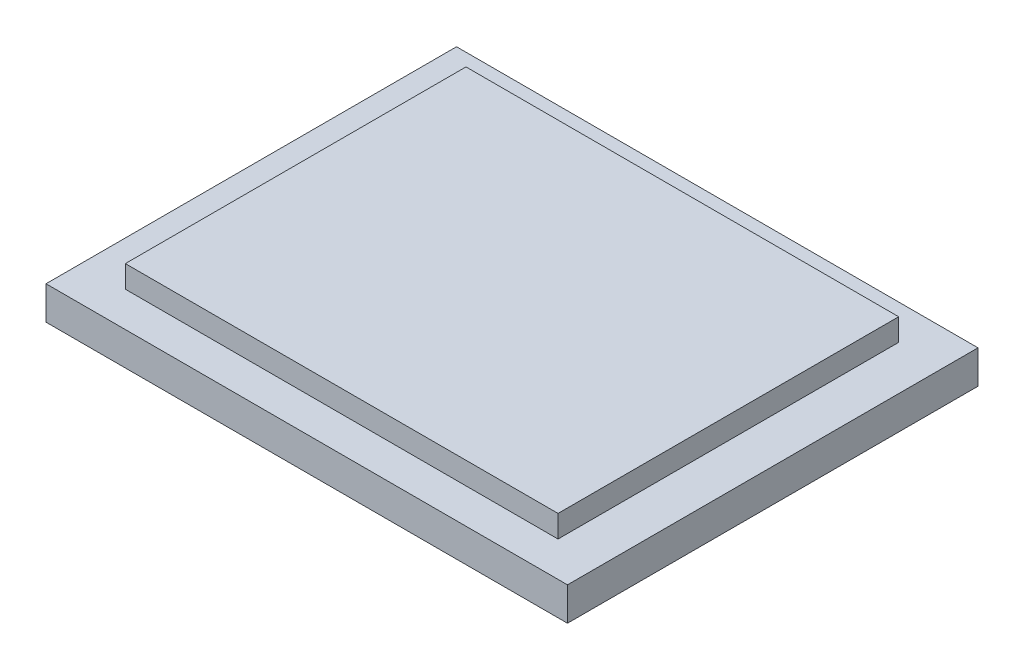
from build123d import *

# Parameters (mm, degrees)
SKETCH2_W           = 59.69
SKETCH2_H           = 46.99
SKETCH2_W_2         = 49.53
SKETCH2_H_2         = 38.991702128
BOSS_EXTRUDE1_DEPTH = 3.81
SKETCH2_3_W         = 49.53
SKETCH2_3_H         = 38.991702128
BOSS_EXTRUDE2_DEPTH = 6.35
SKETCH4_W           = 0.284935897
SKETCH4_H           = 3.175
SKETCH4_W_2         = 0.237446582
SKETCH4_H_2         = 2.645833333
CUT_EXTRUDE1_DEPTH  = 0.635


with BuildPart() as part:
    # Sketch2 → Boss-Extrude1 (new body)
    # profile 1 of 2: a face of its own
    with BuildSketch(Plane(origin=(0, 0, 0), x_dir=(1, 0, 0), z_dir=(0, 1, 0))):
        Rectangle(SKETCH2_W, SKETCH2_H)
        Rectangle(SKETCH2_W_2, SKETCH2_H_2, mode=Mode.SUBTRACT)
    # profile 2 of 2: a face of its own
    with BuildSketch(Plane(origin=(0, 0, 0), x_dir=(1, 0, 0), z_dir=(0, 1, 0))):
        Rectangle(SKETCH2_W_2, SKETCH2_H_2)
    extrude(amount=BOSS_EXTRUDE1_DEPTH)

    # Sketch2<3> → Boss-Extrude2 (add)
    with BuildSketch(Plane(origin=(0, 0, 0), x_dir=(1, 0, 0), z_dir=(0, 1, 0))):
        Rectangle(SKETCH2_3_W, SKETCH2_3_H)
    extrude(amount=BOSS_EXTRUDE2_DEPTH)

    # Sketch4 → Cut-Extrude1 (cut)
    # profile 1 of 50: a face of its own
    with BuildSketch(Plane.XZ):
        with BuildLine():
            Line((-20.433974359, -10.795), (-21.06935597, -10.795))
            add(Edge.make_bspline(
                [(-21.06935597, -10.795), (-21.11175685, -10.794858861), (-21.193171239, -10.794587859), (-21.309805562, -10.793076774), (-21.415784429, -10.788745752), (-21.511052426, -10.78501868), (-21.595607806, -10.778222418), (-21.669709848, -10.771726689), (-21.73301726, -10.763223439), (-21.771340282, -10.755326377), (-21.788691907, -10.751750801)],
                knots=[0, 0, 0, 0, 1.410062039, 2.707475311, 3.878576406, 4.937260626, 5.877586885, 6.699081471, 7.410979367, 8, 8, 8, 8], degree=3))
            add(Edge.make_bspline(
                [(-21.788691907, -10.751750801), (-21.811921164, -10.746012157), (-21.857884136, -10.734657289), (-21.924054593, -10.710645431), (-21.987134949, -10.682903072), (-22.046894203, -10.650069764), (-22.103316695, -10.612699938), (-22.15639674, -10.570643367), (-22.205422639, -10.523539711), (-22.252138659, -10.473340189), (-22.292930668, -10.417859177), (-22.329654297, -10.359912187), (-22.360482526, -10.298383597), (-22.384740901, -10.233583742), (-22.405077408, -10.166148276), (-22.418745439, -10.095410846), (-22.427258128, -10.021601594), (-22.428099182, -9.971380999), (-22.428525641, -9.945916466)],
                knots=[0, 0, 0, 0, 1.027276577, 2.032638556, 3.019345632, 3.985365262, 4.957888996, 5.923693931, 6.890056973, 7.876427719, 8.865527834, 9.843495157, 10.821038291, 11.815616373, 12.812734995, 13.843357168, 14.906466538, 16, 16, 16, 16], degree=3))
            add(Edge.make_bspline(
                [(-22.428525641, -9.945916466), (-22.427193084, -9.903611716), (-22.424592921, -9.82106419), (-22.400348952, -9.701266784), (-22.360639161, -9.589513991), (-22.305910812, -9.485961331), (-22.23624866, -9.392572769), (-22.152530593, -9.310823983), (-22.055184155, -9.241783409), (-21.964135538, -9.19441549), (-21.883669804, -9.163936941), (-21.817230961, -9.142384467), (-21.744702382, -9.126013281), (-21.6671246, -9.11113416), (-21.583898397, -9.099780196), (-21.49519137, -9.091716723), (-21.400781658, -9.086531849), (-21.336066303, -9.085774317), (-21.302774439, -9.085384615)],
                knots=[0, 0, 0, 0, 1.260402266, 2.459371274, 3.627181936, 4.786749125, 5.93865593, 7.087644312, 8.261344208, 9.485713728, 10.136162886, 10.825977872, 11.566646758, 12.35154167, 13.181268117, 14.0701832, 15.007234106, 16, 16, 16, 16], degree=3))
            Line((-21.302774439, -9.085384615), (-22.469230769, -7.62))
            Line((-22.469230769, -7.62), (-22.116877003, -7.62))
            Line((-22.116877003, -7.62), (-20.950420673, -9.085384615))
            Line((-20.950420673, -9.085384615), (-20.718910256, -9.085384615))
            Line((-20.718910256, -9.085384615), (-20.718910256, -7.62))
            Line((-20.718910256, -7.62), (-20.433974359, -7.62))
            Line((-20.433974359, -7.62), (-20.433974359, -10.795))
        make_face()
        with BuildLine():
            Line((-20.718910256, -10.469358974), (-20.718910256, -9.411025641))
            Line((-20.718910256, -9.411025641), (-21.300230369, -9.406573518))
            add(Edge.make_bspline(
                [(-21.300230369, -9.406573518), (-21.327372122, -9.406561503), (-21.379980569, -9.406538216), (-21.456090412, -9.410161235), (-21.526956671, -9.414282356), (-21.592307398, -9.420587465), (-21.652174727, -9.428708419), (-21.706519115, -9.438882483), (-21.755460654, -9.45068556), (-21.81235905, -9.469140582), (-21.876625883, -9.497118501), (-21.94502928, -9.540500695), (-22.004846093, -9.592965065), (-22.054577168, -9.65371599), (-22.094521224, -9.720797567), (-22.122265929, -9.792691639), (-22.140549528, -9.868265446), (-22.142564654, -9.920155937), (-22.143589744, -9.946552484)],
                knots=[0, 0, 0, 0, 1.146399208, 2.222048177, 3.218135709, 4.144938032, 4.994811973, 5.769438708, 6.479732432, 7.119818093, 8.294689872, 9.430121864, 10.527913442, 11.641375077, 12.733452768, 13.811150417, 14.886538365, 16, 16, 16, 16], degree=3))
            add(Edge.make_bspline(
                [(-22.143589744, -9.946552484), (-22.14251275, -9.972090441), (-22.140378543, -10.022697352), (-22.122557043, -10.096617823), (-22.093457357, -10.166906489), (-22.053627356, -10.232596132), (-22.004054648, -10.291783429), (-21.946313607, -10.342270277), (-21.88176301, -10.384213311), (-21.821920406, -10.411887428), (-21.768040987, -10.428170921), (-21.721475946, -10.43999109), (-21.668402701, -10.448269402), (-21.609445918, -10.455883237), (-21.544346604, -10.462330988), (-21.473065087, -10.466610688), (-21.395652335, -10.469168671), (-21.341997633, -10.469294064), (-21.314222756, -10.469358974)],
                knots=[0, 0, 0, 0, 1.100596872, 2.180981401, 3.259506136, 4.371595435, 5.481727359, 6.576991111, 7.667816242, 8.793363246, 9.406619729, 10.09427138, 10.864108636, 11.721733836, 12.6590937, 13.685439239, 14.801845161, 16, 16, 16, 16], degree=3))
            Line((-21.314222756, -10.469358974), (-20.718910256, -10.469358974))
        make_face(mode=Mode.SUBTRACT)
    # profile 2 of 50: a face of its own
    with BuildSketch(Plane.XZ):
        Polygon((-18.073076923, -10.795), (-19.864102564, -10.795), (-19.864102564, -10.469358974), (-18.358012821, -10.469358974), (-18.358012821, -9.492435897), (-19.864102564, -9.492435897), (-19.864102564, -9.166794872), (-18.358012821, -9.166794872), (-18.358012821, -7.945641026), (-19.864102564, -7.945641026), (-19.864102564, -7.62), (-18.073076923, -7.62), align=None)
    # profile 3 of 50: a face of its own
    with BuildSketch(Plane.XZ):
        Polygon((-16.037820513, -10.795), (-16.32275641, -10.795), (-16.32275641, -7.945641026), (-17.543910256, -7.945641026), (-17.543910256, -7.62), (-16.037820513, -7.62), align=None)
    # profile 4 of 50: a face of its own
    with BuildSketch(Plane.XZ):
        Polygon((-14.002564103, -10.795), (-14.2875, -10.795), (-14.2875, -7.945641026), (-15.508653846, -7.945641026), (-15.508653846, -7.62), (-14.002564103, -7.62), align=None)
    # profile 5 of 50: a face of its own
    with BuildSketch(Plane.XZ):
        with BuildLine():
            add(Edge.make_bspline(
                [(-11.662019231, -10.876410256), (-11.720815839, -10.874946254), (-11.836297229, -10.872070833), (-12.00586192, -10.849333684), (-12.168226942, -10.81190969), (-12.323489269, -10.759062605), (-12.471045051, -10.690540104), (-12.611360795, -10.607352249), (-12.743954198, -10.508681469), (-12.868482317, -10.396870036), (-12.981666336, -10.27396591), (-13.080154773, -10.142019673), (-13.163977619, -10.003687034), (-13.23246388, -9.858067121), (-13.286278017, -9.705810083), (-13.323391483, -9.546008893), (-13.347104146, -9.379724725), (-13.349875949, -9.266307335), (-13.351282051, -9.208772035)],
                knots=[0, 0, 0, 0, 1.065027606, 2.091802087, 3.093458616, 4.079833113, 5.057734272, 6.036020118, 7.030157768, 8.047461502, 9.064242947, 10.052216774, 11.02588392, 11.989864716, 12.962978571, 13.945936472, 14.957997893, 16, 16, 16, 16], degree=3))
            add(Edge.make_bspline(
                [(-13.351282051, -9.208772035), (-13.349875478, -9.151660884), (-13.347102958, -9.039088189), (-13.323372216, -8.873854527), (-13.286112509, -8.715035243), (-13.233129611, -8.56299973), (-13.164592903, -8.41767334), (-13.080638161, -8.279243914), (-12.982370998, -8.146912937), (-12.869651038, -8.023410522), (-12.746559921, -7.910216063), (-12.615428884, -7.810150459), (-12.47641616, -7.726790074), (-12.331691398, -7.657280002), (-12.179814267, -7.604635409), (-12.021855915, -7.566272338), (-11.856920708, -7.542798652), (-11.744566705, -7.540008108), (-11.687459936, -7.538589744)],
                knots=[0, 0, 0, 0, 1.043683505, 2.0572211, 3.045299494, 4.022276905, 4.994977706, 5.977452478, 6.97747046, 8.003698437, 9.029677512, 10.031249186, 11.013723958, 11.988083691, 12.9614021, 13.946617861, 14.956316495, 16, 16, 16, 16], degree=3))
            add(Edge.make_bspline(
                [(-11.687459936, -7.538589744), (-11.629924905, -7.53999507), (-11.516508045, -7.542765343), (-11.350015347, -7.566518322), (-11.190100336, -7.603648015), (-11.037255386, -7.656760714), (-10.89143034, -7.72514423), (-10.752639303, -7.809177416), (-10.620715493, -7.908198984), (-10.497001391, -8.020830424), (-10.383943425, -8.143685506), (-10.284502415, -8.274644367), (-10.200953699, -8.412461512), (-10.132541315, -8.556568833), (-10.078429724, -8.706593838), (-10.04150122, -8.86348024), (-10.017611676, -9.026348919), (-10.01485851, -9.137240595), (-10.013461538, -9.193507612)],
                knots=[0, 0, 0, 0, 1.053167129, 2.076072758, 3.073341244, 4.055601477, 5.033424535, 6.017524495, 7.021518915, 8.049444456, 9.077120685, 10.074910483, 11.055688766, 12.022980584, 12.991883888, 13.970269434, 14.970104079, 16, 16, 16, 16], degree=3))
            add(Edge.make_bspline(
                [(-10.013461538, -9.193507612), (-10.013946085, -9.231274563), (-10.014909064, -9.306332018), (-10.0265195, -9.417787037), (-10.043333091, -9.527461652), (-10.067555646, -9.634987191), (-10.098800689, -9.740381211), (-10.137304903, -9.843428176), (-10.181430747, -9.94497689), (-10.23396866, -10.043094702), (-10.291289095, -10.137935613), (-10.353791271, -10.228313719), (-10.42191098, -10.31261462), (-10.494675151, -10.392192898), (-10.573091001, -10.465690332), (-10.655978374, -10.534709337), (-10.743770975, -10.598535451), (-10.83660765, -10.655828152), (-10.932121493, -10.708452194), (-11.031005461, -10.752388939), (-11.131173202, -10.791223128), (-11.233507033, -10.822084794), (-11.337770239, -10.84664469), (-11.44409316, -10.86333252), (-11.552366285, -10.874968754), (-11.625310989, -10.875927688), (-11.662019231, -10.876410256)],
                knots=[0, 0, 0, 0, 1.037115869, 2.061148057, 3.07517727, 4.084041727, 5.086514338, 6.092668487, 7.104487461, 8.125783165, 9.147610153, 10.147694368, 11.141876323, 12.122903372, 13.107606018, 14.091946891, 15.084523921, 16.086505767, 17.087268121, 18.077809654, 19.05670789, 20.036870126, 21.011670792, 21.99694167, 22.991993299, 24, 24, 24, 24], degree=3))
        make_face()
        with BuildLine():
            add(Edge.make_bspline(
                [(-11.676011619, -10.550769231), (-11.645880747, -10.550403394), (-11.585907056, -10.549675219), (-11.496755659, -10.540023709), (-11.408744823, -10.526379841), (-11.322067905, -10.50651344), (-11.236647392, -10.481058301), (-11.152388468, -10.449624848), (-11.06921589, -10.41292842), (-10.987890228, -10.370332115), (-10.909710285, -10.322586079), (-10.834206308, -10.272245904), (-10.764261886, -10.216458377), (-10.69852602, -10.157292302), (-10.637158191, -10.093933045), (-10.580150202, -10.026847347), (-10.527558217, -9.955731494), (-10.480012633, -9.880881794), (-10.437700907, -9.802715173), (-10.39981741, -9.722726102), (-10.368413445, -9.639974472), (-10.343536823, -9.554976697), (-10.322422272, -9.468107339), (-10.309177663, -9.378893104), (-10.299433681, -9.287641544), (-10.29874551, -9.225971939), (-10.298397436, -9.194779647)],
                knots=[0, 0, 0, 0, 1.008431664, 2.007222653, 2.999229743, 3.989431819, 4.982149843, 5.98167215, 6.998687425, 8.024288174, 9.053028776, 10.065052016, 11.06063401, 12.045759335, 13.024701188, 14.011819507, 14.991481775, 15.984022113, 16.97831254, 17.965966747, 18.945551853, 19.938269878, 20.93007375, 21.936103907, 22.956087853, 24, 24, 24, 24], degree=3))
            add(Edge.make_bspline(
                [(-10.298397436, -9.194779647), (-10.299556564, -9.148913533), (-10.301836927, -9.058680696), (-10.321717828, -8.926433287), (-10.352584891, -8.79921419), (-10.397336301, -8.67778168), (-10.454425555, -8.561594257), (-10.524062856, -8.45110408), (-10.606885933, -8.346343743), (-10.70091034, -8.248093081), (-10.803723551, -8.15845151), (-10.912843724, -8.079656098), (-11.027407541, -8.013339682), (-11.146754685, -7.957900648), (-11.271904121, -7.916135187), (-11.402053441, -7.886356432), (-11.53720552, -7.867055975), (-11.629303828, -7.865181442), (-11.676011619, -7.864230769)],
                knots=[0, 0, 0, 0, 1.032022337, 2.030307203, 3.003823408, 3.974715386, 4.937372378, 5.913284036, 6.909147208, 7.938749767, 8.970518239, 9.975863271, 10.963918693, 11.946286286, 12.933361397, 13.927862637, 14.949112547, 16, 16, 16, 16], degree=3))
            add(Edge.make_bspline(
                [(-11.676011619, -7.864230769), (-11.707407505, -7.86466177), (-11.769674978, -7.865516575), (-11.862288378, -7.87413835), (-11.953241928, -7.887936623), (-12.042367285, -7.907901784), (-12.129782305, -7.932557284), (-12.215219198, -7.963144645), (-12.298664688, -7.999793866), (-12.380472192, -8.040703744), (-12.458869763, -8.086842414), (-12.532967111, -8.137537504), (-12.603251512, -8.191431615), (-12.668867393, -8.250169212), (-12.729979023, -8.312994003), (-12.785968149, -8.380363532), (-12.838535613, -8.450946638), (-12.88574772, -8.525777313), (-12.92863988, -8.603325428), (-12.965410496, -8.683547358), (-12.996832507, -8.765935004), (-13.022157309, -8.850569672), (-13.042013343, -8.937255424), (-13.055692226, -9.026117826), (-13.065261372, -9.116976542), (-13.065982592, -9.178429913), (-13.066346154, -9.209408053)],
                knots=[0, 0, 0, 0, 1.047362266, 2.077233941, 3.100744636, 4.115120168, 5.122788643, 6.129711893, 7.140355774, 8.162227187, 9.180148637, 10.17298275, 11.156396779, 12.133377858, 13.108923632, 14.078087502, 15.054351192, 16.043448276, 17.028082865, 18.009331763, 18.985518559, 19.968016174, 20.954783108, 21.950335389, 22.966780876, 24, 24, 24, 24], degree=3))
            add(Edge.make_bspline(
                [(-13.066346154, -9.209408053), (-13.065982287, -9.24017426), (-13.06526049, -9.3012047), (-13.05569696, -9.391429871), (-13.041998295, -9.479652427), (-13.02225641, -9.56552602), (-12.996810914, -9.64907254), (-12.965435261, -9.730213513), (-12.928437181, -9.809251252), (-12.885975385, -9.885990293), (-12.838245499, -9.959627643), (-12.786089333, -10.030023128), (-12.728610425, -10.095860664), (-12.66743598, -10.158743329), (-12.601095243, -10.217413391), (-12.529576584, -10.271643962), (-12.454660931, -10.323879246), (-12.374653321, -10.370105839), (-12.292381179, -10.41301814), (-12.207874236, -10.449598456), (-12.122189247, -10.481197924), (-12.035211768, -10.50640381), (-11.947092048, -10.526399139), (-11.857805602, -10.540018764), (-11.767385582, -10.549676256), (-11.70656626, -10.55040375), (-11.676011619, -10.550769231)],
                knots=[0, 0, 0, 0, 1.02988216, 2.042960975, 3.035124439, 4.018561492, 4.99104521, 5.957523397, 6.929462691, 7.91146347, 8.892205782, 9.866320947, 10.842813644, 11.816825305, 12.802668543, 13.805243666, 14.821427616, 15.858893029, 16.897256944, 17.927432741, 18.940436917, 19.95373962, 20.957947499, 21.96413624, 22.977215056, 24, 24, 24, 24], degree=3))
        make_face(mode=Mode.SUBTRACT)
    # profile 6 of 50: a face of its own
    with BuildSketch(Plane.XZ):
        with BuildLine():
            Line((-7.48974359, -10.795), (-8.1251252, -10.795))
            add(Edge.make_bspline(
                [(-8.1251252, -10.795), (-8.167526081, -10.794858861), (-8.248940469, -10.794587859), (-8.365574793, -10.793076774), (-8.47155366, -10.788745752), (-8.566821657, -10.78501868), (-8.651377037, -10.778222418), (-8.725479079, -10.771726689), (-8.78878649, -10.763223439), (-8.827109513, -10.755326377), (-8.844461138, -10.751750801)],
                knots=[0, 0, 0, 0, 1.410062039, 2.707475311, 3.878576406, 4.937260626, 5.877586885, 6.699081471, 7.410979367, 8, 8, 8, 8], degree=3))
            add(Edge.make_bspline(
                [(-8.844461138, -10.751750801), (-8.867690395, -10.746012157), (-8.913653367, -10.734657289), (-8.979823824, -10.710645431), (-9.04290418, -10.682903072), (-9.102663434, -10.650069764), (-9.159085925, -10.612699938), (-9.212165971, -10.570643367), (-9.26119187, -10.523539711), (-9.30790789, -10.473340189), (-9.348699899, -10.417859177), (-9.385423528, -10.359912187), (-9.416251756, -10.298383597), (-9.440510132, -10.233583742), (-9.460846638, -10.166148276), (-9.474514669, -10.095410846), (-9.483027358, -10.021601594), (-9.483868412, -9.971380999), (-9.484294872, -9.945916466)],
                knots=[0, 0, 0, 0, 1.027276577, 2.032638556, 3.019345632, 3.985365262, 4.957888996, 5.923693931, 6.890056973, 7.876427719, 8.865527834, 9.843495157, 10.821038291, 11.815616373, 12.812734995, 13.843357168, 14.906466538, 16, 16, 16, 16], degree=3))
            add(Edge.make_bspline(
                [(-9.484294872, -9.945916466), (-9.482962315, -9.903611716), (-9.480362152, -9.82106419), (-9.456118182, -9.701266784), (-9.416408392, -9.589513991), (-9.361680043, -9.485961331), (-9.29201789, -9.392572769), (-9.208299824, -9.310823983), (-9.110953386, -9.241783409), (-9.019904769, -9.19441549), (-8.939439035, -9.163936941), (-8.873000191, -9.142384467), (-8.800471613, -9.126013281), (-8.722893831, -9.11113416), (-8.639667628, -9.099780196), (-8.550960601, -9.091716723), (-8.456550889, -9.086531849), (-8.391835533, -9.085774317), (-8.35854367, -9.085384615)],
                knots=[0, 0, 0, 0, 1.260402266, 2.459371274, 3.627181936, 4.786749125, 5.93865593, 7.087644312, 8.261344208, 9.485713728, 10.136162886, 10.825977872, 11.566646758, 12.35154167, 13.181268117, 14.0701832, 15.007234106, 16, 16, 16, 16], degree=3))
            Line((-8.35854367, -9.085384615), (-9.525, -7.62))
            Line((-9.525, -7.62), (-9.172646234, -7.62))
            Line((-9.172646234, -7.62), (-8.006189904, -9.085384615))
            Line((-8.006189904, -9.085384615), (-7.774679487, -9.085384615))
            Line((-7.774679487, -9.085384615), (-7.774679487, -7.62))
            Line((-7.774679487, -7.62), (-7.48974359, -7.62))
            Line((-7.48974359, -7.62), (-7.48974359, -10.795))
        make_face()
        with BuildLine():
            Line((-7.774679487, -10.469358974), (-7.774679487, -9.411025641))
            Line((-7.774679487, -9.411025641), (-8.355999599, -9.406573518))
            add(Edge.make_bspline(
                [(-8.355999599, -9.406573518), (-8.383141352, -9.406561503), (-8.4357498, -9.406538216), (-8.511859643, -9.410161235), (-8.582725902, -9.414282356), (-8.648076629, -9.420587465), (-8.707943958, -9.428708419), (-8.762288345, -9.438882483), (-8.811229885, -9.45068556), (-8.868128281, -9.469140582), (-8.932395113, -9.497118501), (-9.000798511, -9.540500695), (-9.060615323, -9.592965065), (-9.110346399, -9.65371599), (-9.150290455, -9.720797567), (-9.17803516, -9.792691639), (-9.196318759, -9.868265446), (-9.198333885, -9.920155937), (-9.199358974, -9.946552484)],
                knots=[0, 0, 0, 0, 1.146399208, 2.222048177, 3.218135709, 4.144938032, 4.994811973, 5.769438708, 6.479732432, 7.119818093, 8.294689872, 9.430121864, 10.527913442, 11.641375077, 12.733452768, 13.811150417, 14.886538365, 16, 16, 16, 16], degree=3))
            add(Edge.make_bspline(
                [(-9.199358974, -9.946552484), (-9.198281981, -9.972090441), (-9.196147773, -10.022697352), (-9.178326274, -10.096617823), (-9.149226588, -10.166906489), (-9.109396587, -10.232596132), (-9.059823878, -10.291783429), (-9.002082838, -10.342270277), (-8.93753224, -10.384213311), (-8.877689636, -10.411887428), (-8.823810218, -10.428170921), (-8.777245176, -10.43999109), (-8.724171932, -10.448269402), (-8.665215149, -10.455883237), (-8.600115835, -10.462330988), (-8.528834318, -10.466610688), (-8.451421566, -10.469168671), (-8.397766864, -10.469294064), (-8.369991987, -10.469358974)],
                knots=[0, 0, 0, 0, 1.100596872, 2.180981401, 3.259506136, 4.371595435, 5.481727359, 6.576991111, 7.667816242, 8.793363246, 9.406619729, 10.09427138, 10.864108636, 11.721733836, 12.6590937, 13.685439239, 14.801845161, 16, 16, 16, 16], degree=3))
            Line((-8.369991987, -10.469358974), (-7.774679487, -10.469358974))
        make_face(mode=Mode.SUBTRACT)
    # profile 7 of 50: a face of its own
    with BuildSketch(Plane.XZ):
        Polygon((-5.250961538, -10.469358974), (-5.250961538, -10.795), (-6.919871795, -10.795), (-6.919871795, -10.469358974), (-6.227884615, -10.469358974), (-6.227884615, -7.62), (-5.942948718, -7.62), (-5.942948718, -10.469358974), align=None)
    # profile 8 of 50: a face of its own
    with BuildSketch(Plane.XZ):
        Polygon((-2.360897436, -7.62), (-2.360897436, -10.795), (-2.420683093, -10.795), (-4.518269231, -8.296086739), (-4.518269231, -10.795), (-4.803205128, -10.795), (-4.803205128, -7.62), (-4.73833133, -7.62), (-2.645833333, -10.113189103), (-2.645833333, -7.62), align=None)
    # profile 9 of 50: a face of its own
    with BuildSketch(Plane.XZ):
        with BuildLine():
            add(Edge.make_bspline(
                [(-0.020352564, -10.876410256), (-0.079149173, -10.874946254), (-0.194630563, -10.872070833), (-0.364195254, -10.849333684), (-0.526560275, -10.81190969), (-0.681822602, -10.759062605), (-0.829378384, -10.690540104), (-0.969694128, -10.607352249), (-1.102287532, -10.508681469), (-1.226815651, -10.396870036), (-1.339999669, -10.27396591), (-1.438488107, -10.142019673), (-1.522310952, -10.003687034), (-1.590797214, -9.858067121), (-1.64461135, -9.705810083), (-1.681724817, -9.546008893), (-1.705437479, -9.379724725), (-1.708209282, -9.266307335), (-1.709615385, -9.208772035)],
                knots=[0, 0, 0, 0, 1.065027606, 2.091802087, 3.093458616, 4.079833113, 5.057734272, 6.036020118, 7.030157768, 8.047461502, 9.064242947, 10.052216774, 11.02588392, 11.989864716, 12.962978571, 13.945936472, 14.957997893, 16, 16, 16, 16], degree=3))
            add(Edge.make_bspline(
                [(-1.709615385, -9.208772035), (-1.708208811, -9.151660884), (-1.705436291, -9.039088189), (-1.681705549, -8.873854527), (-1.644445843, -8.715035243), (-1.591462945, -8.56299973), (-1.522926236, -8.41767334), (-1.438971495, -8.279243914), (-1.340704331, -8.146912937), (-1.227984372, -8.023410522), (-1.104893255, -7.910216063), (-0.973762217, -7.810150459), (-0.834749493, -7.726790074), (-0.690024732, -7.657280002), (-0.5381476, -7.604635409), (-0.380189249, -7.566272338), (-0.215254041, -7.542798652), (-0.102900038, -7.540008108), (-0.045793269, -7.538589744)],
                knots=[0, 0, 0, 0, 1.043683505, 2.0572211, 3.045299494, 4.022276905, 4.994977706, 5.977452478, 6.97747046, 8.003698437, 9.029677512, 10.031249186, 11.013723958, 11.988083691, 12.9614021, 13.946617861, 14.956316495, 16, 16, 16, 16], degree=3))
            add(Edge.make_bspline(
                [(-0.045793269, -7.538589744), (0.011741761, -7.53999507), (0.125158622, -7.542765343), (0.291651319, -7.566518322), (0.451566331, -7.603648015), (0.604411281, -7.656760714), (0.750236326, -7.72514423), (0.889027364, -7.809177416), (1.020951173, -7.908198984), (1.144665276, -8.020830424), (1.257723242, -8.143685506), (1.357164252, -8.274644367), (1.440712968, -8.412461512), (1.509125352, -8.556568833), (1.563236942, -8.706593838), (1.600165447, -8.86348024), (1.62405499, -9.026348919), (1.626808157, -9.137240595), (1.628205128, -9.193507612)],
                knots=[0, 0, 0, 0, 1.053167129, 2.076072758, 3.073341244, 4.055601477, 5.033424535, 6.017524495, 7.021518915, 8.049444456, 9.077120685, 10.074910483, 11.055688766, 12.022980584, 12.991883888, 13.970269434, 14.970104079, 16, 16, 16, 16], degree=3))
            add(Edge.make_bspline(
                [(1.628205128, -9.193507612), (1.627720582, -9.231274563), (1.626757603, -9.306332018), (1.615147167, -9.417787037), (1.598333576, -9.527461652), (1.57411102, -9.634987191), (1.542865978, -9.740381211), (1.504361764, -9.843428176), (1.460235919, -9.94497689), (1.407698007, -10.043094702), (1.350377571, -10.137935613), (1.287875396, -10.228313719), (1.219755686, -10.31261462), (1.146991516, -10.392192898), (1.068575666, -10.465690332), (0.985688293, -10.534709337), (0.897895692, -10.598535451), (0.805059017, -10.655828152), (0.709545174, -10.708452194), (0.610661206, -10.752388939), (0.510493464, -10.791223128), (0.408159633, -10.822084794), (0.303896428, -10.84664469), (0.197573507, -10.86333252), (0.089300382, -10.874968754), (0.016355678, -10.875927688), (-0.020352564, -10.876410256)],
                knots=[0, 0, 0, 0, 1.037115869, 2.061148057, 3.07517727, 4.084041727, 5.086514338, 6.092668487, 7.104487461, 8.125783165, 9.147610153, 10.147694368, 11.141876323, 12.122903372, 13.107606018, 14.091946891, 15.084523921, 16.086505767, 17.087268121, 18.077809654, 19.05670789, 20.036870126, 21.011670792, 21.99694167, 22.991993299, 24, 24, 24, 24], degree=3))
        make_face()
        with BuildLine():
            add(Edge.make_bspline(
                [(-0.034344952, -10.550769231), (-0.00421408, -10.550403394), (0.055759611, -10.549675219), (0.144911007, -10.540023709), (0.232921844, -10.526379841), (0.319598761, -10.50651344), (0.405019275, -10.481058301), (0.489278199, -10.449624848), (0.572450777, -10.41292842), (0.653776439, -10.370332115), (0.731956382, -10.322586079), (0.807460358, -10.272245904), (0.87740478, -10.216458377), (0.943140647, -10.157292302), (1.004508476, -10.093933045), (1.061516465, -10.026847347), (1.11410845, -9.955731494), (1.161654033, -9.880881794), (1.203965759, -9.802715173), (1.241849257, -9.722726102), (1.273253222, -9.639974472), (1.298129844, -9.554976697), (1.319244395, -9.468107339), (1.332489004, -9.378893104), (1.342232986, -9.287641544), (1.342921156, -9.225971939), (1.343269231, -9.194779647)],
                knots=[0, 0, 0, 0, 1.008431664, 2.007222653, 2.999229743, 3.989431819, 4.982149843, 5.98167215, 6.998687425, 8.024288174, 9.053028776, 10.065052016, 11.06063401, 12.045759335, 13.024701188, 14.011819507, 14.991481775, 15.984022113, 16.97831254, 17.965966747, 18.945551853, 19.938269878, 20.93007375, 21.936103907, 22.956087853, 24, 24, 24, 24], degree=3))
            add(Edge.make_bspline(
                [(1.343269231, -9.194779647), (1.342110103, -9.148913533), (1.33982974, -9.058680696), (1.319948839, -8.926433287), (1.289081776, -8.79921419), (1.244330366, -8.67778168), (1.187241111, -8.561594257), (1.117603811, -8.45110408), (1.034780734, -8.346343743), (0.940756327, -8.248093081), (0.837943115, -8.15845151), (0.728822943, -8.079656098), (0.614259126, -8.013339682), (0.494911982, -7.957900648), (0.369762545, -7.916135187), (0.239613226, -7.886356432), (0.104461147, -7.867055975), (0.012362838, -7.865181442), (-0.034344952, -7.864230769)],
                knots=[0, 0, 0, 0, 1.032022337, 2.030307203, 3.003823408, 3.974715386, 4.937372378, 5.913284036, 6.909147208, 7.938749767, 8.970518239, 9.975863271, 10.963918693, 11.946286286, 12.933361397, 13.927862637, 14.949112547, 16, 16, 16, 16], degree=3))
            add(Edge.make_bspline(
                [(-0.034344952, -7.864230769), (-0.065740839, -7.86466177), (-0.128008311, -7.865516575), (-0.220621711, -7.87413835), (-0.311575262, -7.887936623), (-0.400700618, -7.907901784), (-0.488115638, -7.932557284), (-0.573552531, -7.963144645), (-0.656998022, -7.999793866), (-0.738805525, -8.040703744), (-0.817203097, -8.086842414), (-0.891300444, -8.137537504), (-0.961584845, -8.191431615), (-1.027200727, -8.250169212), (-1.088312356, -8.312994003), (-1.144301483, -8.380363532), (-1.196868947, -8.450946638), (-1.244081053, -8.525777313), (-1.286973213, -8.603325428), (-1.32374383, -8.683547358), (-1.355165841, -8.765935004), (-1.380490643, -8.850569672), (-1.400346676, -8.937255424), (-1.414025559, -9.026117826), (-1.423594705, -9.116976542), (-1.424315926, -9.178429913), (-1.424679487, -9.209408053)],
                knots=[0, 0, 0, 0, 1.047362266, 2.077233941, 3.100744636, 4.115120168, 5.122788643, 6.129711893, 7.140355774, 8.162227187, 9.180148637, 10.17298275, 11.156396779, 12.133377858, 13.108923632, 14.078087502, 15.054351192, 16.043448276, 17.028082865, 18.009331763, 18.985518559, 19.968016174, 20.954783108, 21.950335389, 22.966780876, 24, 24, 24, 24], degree=3))
            add(Edge.make_bspline(
                [(-1.424679487, -9.209408053), (-1.42431562, -9.24017426), (-1.423593824, -9.3012047), (-1.414030293, -9.391429871), (-1.400331628, -9.479652427), (-1.380589743, -9.56552602), (-1.355144247, -9.64907254), (-1.323768594, -9.730213513), (-1.286770514, -9.809251252), (-1.244308719, -9.885990293), (-1.196578832, -9.959627643), (-1.144422666, -10.030023128), (-1.086943759, -10.095860664), (-1.025769313, -10.158743329), (-0.959428576, -10.217413391), (-0.887909917, -10.271643962), (-0.812994264, -10.323879246), (-0.732986654, -10.370105839), (-0.650714512, -10.41301814), (-0.566207569, -10.449598456), (-0.48052258, -10.481197924), (-0.393545101, -10.50640381), (-0.305425381, -10.526399139), (-0.216138935, -10.540018764), (-0.125718916, -10.549676256), (-0.064899593, -10.55040375), (-0.034344952, -10.550769231)],
                knots=[0, 0, 0, 0, 1.02988216, 2.042960975, 3.035124439, 4.018561492, 4.99104521, 5.957523397, 6.929462691, 7.91146347, 8.892205782, 9.866320947, 10.842813644, 11.816825305, 12.802668543, 13.805243666, 14.821427616, 15.858893029, 16.897256944, 17.927432741, 18.940436917, 19.95373962, 20.957947499, 21.96413624, 22.977215056, 24, 24, 24, 24], degree=3))
        make_face(mode=Mode.SUBTRACT)
    # profile 10 of 50: a face of its own
    with BuildSketch(Plane.XZ):
        with BuildLine():
            Line((2.116666667, -10.212407853), (2.365985577, -10.021602564))
            add(Edge.make_bspline(
                [(2.365985577, -10.021602564), (2.383771101, -10.042798556), (2.419102361, -10.084904773), (2.47594053, -10.144036051), (2.535188472, -10.199415555), (2.596763753, -10.251399106), (2.662091367, -10.297897376), (2.728682147, -10.342531692), (2.798955632, -10.38161057), (2.895636979, -10.429350309), (3.022605826, -10.47808052), (3.181886361, -10.519992707), (3.348388639, -10.546421568), (3.461956406, -10.54930341), (3.519721554, -10.550769231)],
                knots=[0, 0, 0, 0, 0.75789156, 1.505565099, 2.245254514, 2.979266606, 3.711207489, 4.440978832, 5.174393176, 5.91211879, 7.394186119, 8.890401545, 10.418332761, 12, 12, 12, 12], degree=3))
            add(Edge.make_bspline(
                [(3.519721554, -10.550769231), (3.551546732, -10.550401126), (3.614901719, -10.549668331), (3.708931401, -10.540068742), (3.801383349, -10.526421017), (3.891913766, -10.506663101), (3.980342903, -10.480940088), (4.067344068, -10.450773856), (4.151892642, -10.413235056), (4.235006057, -10.371778411), (4.314630871, -10.324940219), (4.389984649, -10.273867284), (4.460727538, -10.219064145), (4.52703945, -10.160660309), (4.588252191, -10.097973952), (4.64501605, -10.031709393), (4.697258575, -9.961567376), (4.744925864, -9.887883044), (4.787561248, -9.811020375), (4.824533052, -9.731309528), (4.85578508, -9.64905502), (4.881138697, -9.564433131), (4.900981474, -9.477743403), (4.914716902, -9.388675439), (4.92422805, -9.297384926), (4.924954387, -9.235509525), (4.925320513, -9.204319912)],
                knots=[0, 0, 0, 0, 1.054960097, 2.100129169, 3.131228542, 4.15308236, 5.169990287, 6.183953224, 7.204064171, 8.235355279, 9.262684623, 10.264978336, 11.252191258, 12.228402777, 13.192898315, 14.155264692, 15.119862721, 16.091023151, 17.063429752, 18.032246104, 19.00241354, 19.978852882, 20.959535218, 21.948948728, 22.966123959, 24, 24, 24, 24], degree=3))
            add(Edge.make_bspline(
                [(4.925320513, -9.204319912), (4.924173179, -9.157393261), (4.92192054, -9.065259005), (4.901957653, -8.930287958), (4.87137842, -8.80086148), (4.826298825, -8.677855905), (4.769604083, -8.560245832), (4.698864677, -8.449457526), (4.616625968, -8.343867904), (4.522044292, -8.246034286), (4.418259129, -8.156669527), (4.306909965, -8.077974022), (4.18826974, -8.012374181), (4.063649563, -7.957785977), (3.932090146, -7.915824524), (3.79382815, -7.88628421), (3.649164268, -7.867014518), (3.550313455, -7.865169672), (3.500005008, -7.864230769)],
                knots=[0, 0, 0, 0, 1.029159485, 2.020618137, 2.987588728, 3.942669054, 4.889339625, 5.846988364, 6.821327795, 7.821533711, 8.827683044, 9.822769455, 10.807800696, 11.797391277, 12.803701919, 13.832062008, 14.896664671, 16, 16, 16, 16], degree=3))
            add(Edge.make_bspline(
                [(3.500005008, -7.864230769), (3.44457614, -7.865762734), (3.335478868, -7.868778006), (3.175487873, -7.894322468), (3.022329714, -7.935740722), (2.875996154, -7.993705266), (2.736899725, -8.069057348), (2.604822754, -8.160404709), (2.479653758, -8.268616268), (2.404386952, -8.351241677), (2.365985577, -8.393397436)],
                knots=[0, 0, 0, 0, 1.028121516, 2.023589091, 2.998037872, 3.967518031, 4.937445131, 5.927275754, 6.942489185, 8, 8, 8, 8], degree=3))
            Line((2.365985577, -8.393397436), (2.116666667, -8.2045002))
            add(Edge.make_bspline(
                [(2.116666667, -8.2045002), (2.136731629, -8.178612599), (2.176765444, -8.126961397), (2.241578034, -8.054130857), (2.309902801, -7.9856851), (2.381924193, -7.921980588), (2.457736229, -7.862698903), (2.537305773, -7.808115694), (2.62023596, -7.757625469), (2.706630632, -7.711862011), (2.796494518, -7.671140177), (2.889057505, -7.635549388), (2.984489149, -7.605664057), (3.082036896, -7.580554193), (3.182703046, -7.562620953), (3.285335803, -7.548348839), (3.390890743, -7.539879677), (3.462040973, -7.539023579), (3.498096955, -7.538589744)],
                knots=[0, 0, 0, 0, 0.986880684, 1.969034265, 2.935876267, 3.899990983, 4.864973347, 5.834408638, 6.8063673, 7.789580233, 8.778939794, 9.778051223, 10.776304221, 11.791326552, 12.811423977, 13.855999788, 14.91350973, 16, 16, 16, 16], degree=3))
            add(Edge.make_bspline(
                [(3.498096955, -7.538589744), (3.532245139, -7.538827408), (3.599768943, -7.539297361), (3.699462811, -7.546910255), (3.796517645, -7.557296803), (3.890656056, -7.572936064), (3.982391761, -7.591391287), (4.070893149, -7.616130213), (4.15703109, -7.643842671), (4.240459513, -7.676413623), (4.321249384, -7.713167589), (4.399140127, -7.754707074), (4.474095919, -7.800682766), (4.546853694, -7.85008124), (4.616338645, -7.904489221), (4.683152914, -7.963151096), (4.74767116, -8.025869149), (4.787587882, -8.071094623), (4.807657252, -8.093833133)],
                knots=[0, 0, 0, 0, 1.114604814, 2.203992996, 3.262667896, 4.300477797, 5.318619304, 6.316056647, 7.298880507, 8.271930387, 9.238335007, 10.195173496, 11.151986948, 12.108099108, 13.064862484, 14.031167946, 15.010108607, 16, 16, 16, 16], degree=3))
            add(Edge.make_bspline(
                [(4.807657252, -8.093833133), (4.839800346, -8.133332026), (4.903698475, -8.211852948), (4.985486215, -8.339100376), (5.055262657, -8.47183917), (5.112309259, -8.610838173), (5.156127704, -8.756151423), (5.18693492, -8.907545152), (5.206814769, -9.064716716), (5.209096561, -9.171610011), (5.21025641, -9.225944511)],
                knots=[0, 0, 0, 0, 0.994611881, 1.977215934, 2.950189954, 3.921972279, 4.908960509, 5.911694611, 6.938501887, 8, 8, 8, 8], degree=3))
            add(Edge.make_bspline(
                [(5.21025641, -9.225944511), (5.208839317, -9.283051712), (5.206051276, -9.395406564), (5.182559437, -9.56033561), (5.144310185, -9.718121922), (5.09164071, -9.869372626), (5.022155591, -10.013222321), (4.938038234, -10.150278547), (4.838467017, -10.280429392), (4.724692459, -10.402010866), (4.599892658, -10.513168603), (4.466255168, -10.610965005), (4.324031091, -10.692351404), (4.174790019, -10.760383692), (4.017413689, -10.81267544), (3.85223807, -10.849281549), (3.679573481, -10.872066361), (3.561769709, -10.874946728), (3.501913061, -10.876410256)],
                knots=[0, 0, 0, 0, 1.032901378, 2.032168977, 3.007206631, 3.966850309, 4.924221947, 5.891988639, 6.871730993, 7.884084801, 8.900290346, 9.89161143, 10.874607481, 11.860025555, 12.854717796, 13.869097222, 14.917278314, 16, 16, 16, 16], degree=3))
            add(Edge.make_bspline(
                [(3.501913061, -10.876410256), (3.465432838, -10.875972834), (3.393223911, -10.875107002), (3.286404734, -10.86666578), (3.182410337, -10.852589861), (3.080951421, -10.833406721), (2.981860637, -10.809546582), (2.885583304, -10.779670536), (2.792395286, -10.743548422), (2.701668213, -10.703345403), (2.614565358, -10.657302093), (2.53113005, -10.607255085), (2.452039765, -10.552240644), (2.37678038, -10.493061136), (2.305699841, -10.429261302), (2.237731377, -10.361913533), (2.174893119, -10.289231299), (2.136111013, -10.238062545), (2.116666667, -10.212407853)],
                knots=[0, 0, 0, 0, 1.096566765, 2.170543479, 3.218870886, 4.250164525, 5.273529809, 6.281496242, 7.278154839, 8.276706968, 9.263143576, 10.238168486, 11.199979644, 12.157579042, 13.114563119, 14.070017788, 15.032356758, 16, 16, 16, 16], degree=3))
        make_face()
    # profile 11 of 50: a face of its own
    with BuildSketch(Plane.XZ):
        with BuildLine():
            Line((8.955128205, -10.795), (8.319746595, -10.795))
            add(Edge.make_bspline(
                [(8.319746595, -10.795), (8.277345714, -10.794858861), (8.195931326, -10.794587859), (8.079297002, -10.793076774), (7.973318135, -10.788745752), (7.878050138, -10.78501868), (7.793494758, -10.778222418), (7.719392716, -10.771726689), (7.656085305, -10.763223439), (7.617762282, -10.755326377), (7.600410657, -10.751750801)],
                knots=[0, 0, 0, 0, 1.410062039, 2.707475311, 3.878576406, 4.937260626, 5.877586885, 6.699081471, 7.410979367, 8, 8, 8, 8], degree=3))
            add(Edge.make_bspline(
                [(7.600410657, -10.751750801), (7.5771814, -10.746012157), (7.531218428, -10.734657289), (7.465047971, -10.710645431), (7.401967615, -10.682903072), (7.342208361, -10.650069764), (7.285785869, -10.612699938), (7.232705824, -10.570643367), (7.183679925, -10.523539711), (7.136963905, -10.473340189), (7.096171896, -10.417859177), (7.059448267, -10.359912187), (7.028620038, -10.298383597), (7.004361663, -10.233583742), (6.984025156, -10.166148276), (6.970357125, -10.095410846), (6.961844437, -10.021601594), (6.961003383, -9.971380999), (6.960576923, -9.945916466)],
                knots=[0, 0, 0, 0, 1.027276577, 2.032638556, 3.019345632, 3.985365262, 4.957888996, 5.923693931, 6.890056973, 7.876427719, 8.865527834, 9.843495157, 10.821038291, 11.815616373, 12.812734995, 13.843357168, 14.906466538, 16, 16, 16, 16], degree=3))
            add(Edge.make_bspline(
                [(6.960576923, -9.945916466), (6.96190948, -9.903611716), (6.964509643, -9.82106419), (6.988753613, -9.701266784), (7.028463403, -9.589513991), (7.083191752, -9.485961331), (7.152853905, -9.392572769), (7.236571971, -9.310823983), (7.333918409, -9.241783409), (7.424967026, -9.19441549), (7.50543276, -9.163936941), (7.571871604, -9.142384467), (7.644400182, -9.126013281), (7.721977964, -9.11113416), (7.805204167, -9.099780196), (7.893911194, -9.091716723), (7.988320906, -9.086531849), (8.053036261, -9.085774317), (8.086328125, -9.085384615)],
                knots=[0, 0, 0, 0, 1.260402266, 2.459371274, 3.627181936, 4.786749125, 5.93865593, 7.087644312, 8.261344208, 9.485713728, 10.136162886, 10.825977872, 11.566646758, 12.35154167, 13.181268117, 14.0701832, 15.007234106, 16, 16, 16, 16], degree=3))
            Line((8.086328125, -9.085384615), (6.919871795, -7.62))
            Line((6.919871795, -7.62), (7.272225561, -7.62))
            Line((7.272225561, -7.62), (8.438681891, -9.085384615))
            Line((8.438681891, -9.085384615), (8.670192308, -9.085384615))
            Line((8.670192308, -9.085384615), (8.670192308, -7.62))
            Line((8.670192308, -7.62), (8.955128205, -7.62))
            Line((8.955128205, -7.62), (8.955128205, -10.795))
        make_face()
        with BuildLine():
            Line((8.670192308, -10.469358974), (8.670192308, -9.411025641))
            Line((8.670192308, -9.411025641), (8.088872196, -9.406573518))
            add(Edge.make_bspline(
                [(8.088872196, -9.406573518), (8.061730442, -9.406561503), (8.009121995, -9.406538216), (7.933012152, -9.410161235), (7.862145893, -9.414282356), (7.796795166, -9.420587465), (7.736927837, -9.428708419), (7.682583449, -9.438882483), (7.63364191, -9.45068556), (7.576743514, -9.469140582), (7.512476682, -9.497118501), (7.444073284, -9.540500695), (7.384256472, -9.592965065), (7.334525396, -9.65371599), (7.29458134, -9.720797567), (7.266836635, -9.792691639), (7.248553036, -9.868265446), (7.24653791, -9.920155937), (7.245512821, -9.946552484)],
                knots=[0, 0, 0, 0, 1.146399208, 2.222048177, 3.218135709, 4.144938032, 4.994811973, 5.769438708, 6.479732432, 7.119818093, 8.294689872, 9.430121864, 10.527913442, 11.641375077, 12.733452768, 13.811150417, 14.886538365, 16, 16, 16, 16], degree=3))
            add(Edge.make_bspline(
                [(7.245512821, -9.946552484), (7.246589814, -9.972090441), (7.248724022, -10.022697352), (7.266545521, -10.096617823), (7.295645207, -10.166906489), (7.335475208, -10.232596132), (7.385047917, -10.291783429), (7.442788957, -10.342270277), (7.507339554, -10.384213311), (7.567182159, -10.411887428), (7.621061577, -10.428170921), (7.667626618, -10.43999109), (7.720699863, -10.448269402), (7.779656646, -10.455883237), (7.84475596, -10.462330988), (7.916037477, -10.466610688), (7.993450229, -10.469168671), (8.047104931, -10.469294064), (8.074879808, -10.469358974)],
                knots=[0, 0, 0, 0, 1.100596872, 2.180981401, 3.259506136, 4.371595435, 5.481727359, 6.576991111, 7.667816242, 8.793363246, 9.406619729, 10.09427138, 10.864108636, 11.721733836, 12.6590937, 13.685439239, 14.801845161, 16, 16, 16, 16], degree=3))
            Line((8.074879808, -10.469358974), (8.670192308, -10.469358974))
        make_face(mode=Mode.SUBTRACT)
    # profile 12 of 50: a face of its own
    with BuildSketch(Plane.XZ):
        Polygon((11.316025641, -10.795), (9.525, -10.795), (9.525, -10.469358974), (11.031089744, -10.469358974), (11.031089744, -9.492435897), (9.525, -9.492435897), (9.525, -9.166794872), (11.031089744, -9.166794872), (11.031089744, -7.945641026), (9.525, -7.945641026), (9.525, -7.62), (11.316025641, -7.62), align=None)
    # profile 13 of 50: a face of its own
    with BuildSketch(Plane.XZ):
        Polygon((13.554807692, -10.469358974), (13.554807692, -10.795), (11.885897436, -10.795), (11.885897436, -10.469358974), (12.577884615, -10.469358974), (12.577884615, -7.62), (12.862820513, -7.62), (12.862820513, -10.469358974), align=None)
    # profile 14 of 50: a face of its own
    with BuildSketch(Plane.XZ):
        with Locations((14.022916667, -9.2075)):
            Rectangle(SKETCH4_W, SKETCH4_H)
    # profile 15 of 50: a face of its own
    with BuildSketch(Plane.XZ):
        Polygon((17.421794872, -7.62), (17.421794872, -10.795), (17.362009215, -10.795), (15.264423077, -8.296086739), (15.264423077, -10.795), (14.979487179, -10.795), (14.979487179, -7.62), (15.044360978, -7.62), (17.136858974, -10.113189103), (17.136858974, -7.62), align=None)
    # profile 16 of 50: a face of its own
    with BuildSketch(Plane.XZ):
        with BuildLine():
            Line((18.276602564, -10.253112981), (18.520833333, -10.021602564))
            add(Edge.make_bspline(
                [(18.520833333, -10.021602564), (18.56528711, -10.063120614), (18.652898644, -10.144946281), (18.795052348, -10.25229787), (18.943572827, -10.343543655), (19.097252601, -10.418509022), (19.253128144, -10.476782239), (19.4080874, -10.518916848), (19.561043954, -10.546014547), (19.662590127, -10.549197561), (19.712730369, -10.550769231)],
                knots=[0, 0, 0, 0, 1.091957225, 2.152079168, 3.193085318, 4.218301889, 5.218403563, 6.17723952, 7.099979378, 8, 8, 8, 8], degree=3))
            add(Edge.make_bspline(
                [(19.712730369, -10.550769231), (19.743495674, -10.550393477), (19.804946493, -10.549642944), (19.896227541, -10.540086081), (19.986539056, -10.526298425), (20.075569604, -10.506554371), (20.163673157, -10.480910184), (20.250653721, -10.449948652), (20.336343421, -10.412677572), (20.420291466, -10.37018513), (20.502091183, -10.323797638), (20.579024251, -10.272061848), (20.651411492, -10.216569825), (20.718741016, -10.156593802), (20.781935088, -10.093132011), (20.839836909, -10.025282735), (20.893712709, -9.954050205), (20.941547347, -9.878413355), (20.9847828, -9.80052128), (21.02222102, -9.720994882), (21.054457496, -9.640395043), (21.080216408, -9.558676329), (21.100925587, -9.475890921), (21.115583813, -9.392168163), (21.123816941, -9.307095554), (21.12524409, -9.250129853), (21.125961538, -9.221492388)],
                knots=[0, 0, 0, 0, 1.028307134, 2.053947307, 3.065600992, 4.082111276, 5.100671203, 6.132125737, 7.167228006, 8.222953114, 9.277225349, 10.309459149, 11.320441984, 12.324791754, 13.322338422, 14.312705492, 15.305176196, 16.306142747, 17.302479595, 18.282363326, 19.243345101, 20.20291386, 21.145121196, 22.094978082, 23.042318507, 24, 24, 24, 24], degree=3))
            add(Edge.make_bspline(
                [(21.125961538, -9.221492388), (21.125269439, -9.19221993), (21.12388713, -9.133754947), (21.115221725, -9.046466552), (21.098597459, -8.960652494), (21.078291118, -8.875503207), (21.049548047, -8.79210551), (21.016135122, -8.709238073), (20.975846625, -8.627671048), (20.929453522, -8.547972994), (20.878184162, -8.470414424), (20.821806084, -8.396742499), (20.760212809, -8.327818201), (20.694536762, -8.262633827), (20.624178728, -8.201601015), (20.548456321, -8.145455353), (20.468429452, -8.093328676), (20.384062637, -8.045793632), (20.296247598, -8.003332663), (20.206207835, -7.965573558), (20.113653953, -7.934477378), (20.01907282, -7.909133507), (19.92257706, -7.888359671), (19.823676898, -7.874995205), (19.723099512, -7.865297095), (19.655300896, -7.864588008), (19.62114383, -7.864230769)],
                knots=[0, 0, 0, 0, 0.935896426, 1.86923723, 2.799743935, 3.728471844, 4.66505513, 5.616527375, 6.583419551, 7.570341864, 8.562833498, 9.553750335, 10.533080376, 11.5155245, 12.510142773, 13.507781369, 14.526649666, 15.561487327, 16.601173999, 17.643331812, 18.680652164, 19.71969803, 20.772446191, 21.833473655, 22.9085001, 24, 24, 24, 24], degree=3))
            add(Edge.make_bspline(
                [(19.62114383, -7.864230769), (19.579979019, -7.865090907), (19.499145224, -7.866779926), (19.380324189, -7.879938825), (19.266194162, -7.90046426), (19.157126742, -7.930616848), (19.052725919, -7.968782498), (18.953377426, -8.015980115), (18.858804407, -8.071711532), (18.769425616, -8.134854046), (18.687331319, -8.20518822), (18.612712234, -8.280469815), (18.547754959, -8.361299507), (18.492035868, -8.447659706), (18.444077775, -8.538278787), (18.405822234, -8.634709946), (18.376233417, -8.735876098), (18.364128993, -8.805814892), (18.358012821, -8.841153846)],
                knots=[0, 0, 0, 0, 1.130234505, 2.219399076, 3.279128566, 4.311639422, 5.322903917, 6.328167287, 7.327698761, 8.334124803, 9.329374007, 10.292761544, 11.24113083, 12.171311216, 13.111441694, 14.052040787, 15.015727358, 16, 16, 16, 16], degree=3))
            Line((18.358012821, -8.841153846), (19.416346154, -8.841153846))
            Line((19.416346154, -8.841153846), (19.416346154, -9.166794872))
            Line((19.416346154, -9.166794872), (18.073076923, -9.166794872))
            add(Edge.make_bspline(
                [(18.073076923, -9.166794872), (18.074624371, -9.106100221), (18.077653007, -8.987309826), (18.098897309, -8.814072509), (18.133202288, -8.650449616), (18.180065571, -8.496268829), (18.240731004, -8.351748642), (18.314547512, -8.21674232), (18.402696507, -8.092122045), (18.502038122, -7.976870449), (18.613525941, -7.874064664), (18.734147475, -7.783707849), (18.86410201, -7.707596191), (19.003266621, -7.645674018), (19.151185729, -7.597346894), (19.308201616, -7.563082678), (19.474101354, -7.542554069), (19.587799625, -7.539931175), (19.645948518, -7.538589744)],
                knots=[0, 0, 0, 0, 1.140356446, 2.231883559, 3.274166699, 4.278491846, 5.25512956, 6.21435461, 7.1637429, 8.11826594, 9.068280886, 10.0076534, 10.945064095, 11.891975133, 12.864533718, 13.863980011, 14.907571808, 16, 16, 16, 16], degree=3))
            add(Edge.make_bspline(
                [(19.645948518, -7.538589744), (19.681789855, -7.539106018), (19.752480523, -7.540124277), (19.856884436, -7.547360871), (19.958409706, -7.558501108), (20.057041543, -7.575324184), (20.153142753, -7.59592962), (20.246233377, -7.62231543), (20.336668029, -7.65285775), (20.424586487, -7.687597396), (20.509190754, -7.727848828), (20.590857666, -7.772579715), (20.670038652, -7.821559407), (20.746194351, -7.87563496), (20.819721565, -7.934401906), (20.890146189, -7.997978032), (20.957862478, -8.066168976), (21.000280899, -8.114591364), (21.021654647, -8.138990385)],
                knots=[0, 0, 0, 0, 1.107784379, 2.184907829, 3.233506516, 4.263428166, 5.276301166, 6.270063455, 7.25232949, 8.225834625, 9.190232166, 10.146266622, 11.1027726, 12.066435141, 13.031522626, 14.010570082, 14.99756817, 16, 16, 16, 16], degree=3))
            add(Edge.make_bspline(
                [(21.021654647, -8.138990385), (21.052666171, -8.177698763), (21.11417446, -8.254473), (21.193348216, -8.377481521), (21.260840918, -8.504846065), (21.315603156, -8.636921192), (21.358364134, -8.773583364), (21.389031235, -8.91465795), (21.406999276, -9.060326615), (21.409587842, -9.158901533), (21.410897436, -9.208772035)],
                knots=[0, 0, 0, 0, 1.023165419, 2.029347347, 3.013907458, 3.994755782, 4.975994455, 5.96558838, 6.970761222, 8, 8, 8, 8], degree=3))
            add(Edge.make_bspline(
                [(21.410897436, -9.208772035), (21.410413312, -9.246115315), (21.409451216, -9.320327263), (21.397835886, -9.430512168), (21.381071181, -9.538713334), (21.356788153, -9.645030945), (21.324837774, -9.748992998), (21.286466597, -9.851398331), (21.241523035, -9.951837636), (21.189075546, -10.049420693), (21.131987063, -10.144114129), (21.067791963, -10.232937451), (21.000056398, -10.317608132), (20.925535237, -10.39572898), (20.847020958, -10.469795643), (20.762560631, -10.53785595), (20.67353995, -10.601058206), (20.579240108, -10.658165646), (20.481156883, -10.709481048), (20.379501374, -10.754464445), (20.274311094, -10.791642465), (20.166372374, -10.82318717), (20.054868663, -10.846514498), (19.940608991, -10.863431568), (19.82299782, -10.875007257), (19.743499422, -10.875938217), (19.703190104, -10.876410256)],
                knots=[0, 0, 0, 0, 1.009025537, 2.005226976, 2.991671811, 3.967589759, 4.950148279, 5.929425679, 6.922109907, 7.921964004, 8.922507644, 9.908469609, 10.882248289, 11.851158214, 12.824245259, 13.798023939, 14.780666017, 15.773333703, 16.775582742, 17.771174102, 18.775387309, 19.789283316, 20.80873549, 21.851817535, 22.910773411, 24, 24, 24, 24], degree=3))
            add(Edge.make_bspline(
                [(19.703190104, -10.876410256), (19.6703166, -10.875885888), (19.605132304, -10.874846128), (19.508138908, -10.867601828), (19.412835676, -10.856246934), (19.318744527, -10.840369016), (19.226223722, -10.819365104), (19.134992952, -10.793767414), (19.045224765, -10.764130235), (18.957025955, -10.728756683), (18.869796869, -10.688613714), (18.783054282, -10.643425441), (18.697094086, -10.592421436), (18.611767345, -10.535449628), (18.526535958, -10.473488678), (18.442748033, -10.404766415), (18.358381076, -10.331992915), (18.304132288, -10.279666934), (18.276602564, -10.253112981)],
                knots=[0, 0, 0, 0, 0.985875312, 1.954874891, 2.915472732, 3.863573565, 4.815313299, 5.759461513, 6.704487138, 7.649063459, 8.607849844, 9.583336382, 10.581114205, 11.603942397, 12.659508253, 13.739925933, 14.853076422, 16, 16, 16, 16], degree=3))
        make_face()
    # profile 17 of 50: a face of its own
    with BuildSketch(Plane.XZ):
        with Locations((22.082532052, -9.2075)):
            Rectangle(SKETCH4_W, SKETCH4_H)
    # profile 18 of 50: a face of its own
    with BuildSketch(Plane.XZ):
        with BuildLine():
            Line((-25.525507479, -2.645833333), (-26.041741787, -2.645833333))
            add(Edge.make_bspline(
                [(-26.041741787, -2.645833333), (-26.067012523, -2.645702566), (-26.115993499, -2.645449106), (-26.187213494, -2.641426885), (-26.253944155, -2.636079723), (-26.31606756, -2.627110146), (-26.373987937, -2.617809878), (-26.427117272, -2.604159312), (-26.47590059, -2.589081763), (-26.534479369, -2.565882908), (-26.600945021, -2.529854794), (-26.67238316, -2.476421678), (-26.73448155, -2.412359686), (-26.787283588, -2.339355993), (-26.829658347, -2.259043659), (-26.859926782, -2.173150628), (-26.879372377, -2.083121948), (-26.881347095, -2.021398964), (-26.882345085, -1.990205162)],
                knots=[0, 0, 0, 0, 1.00128172, 1.940733171, 2.826250472, 3.653024905, 4.427672124, 5.149348099, 5.824709082, 6.450061444, 7.643590664, 8.808605388, 9.972104426, 11.165284501, 12.367876273, 13.557044126, 14.765369432, 16, 16, 16, 16], degree=3))
            add(Edge.make_bspline(
                [(-26.882345085, -1.990205162), (-26.881529913, -1.960981939), (-26.879928021, -1.903555549), (-26.864278838, -1.819844385), (-26.840656775, -1.739907728), (-26.806568704, -1.664515923), (-26.763103549, -1.594331437), (-26.710221656, -1.530551438), (-26.647518224, -1.474428136), (-26.600440142, -1.443194721), (-26.576526609, -1.427329561)],
                knots=[0, 0, 0, 0, 1.044356178, 2.052258378, 3.035953355, 4.020338374, 5.002448483, 5.980768927, 6.974322109, 8, 8, 8, 8], degree=3))
            add(Edge.make_bspline(
                [(-26.576526609, -1.427329561), (-26.606585732, -1.415795122), (-26.664096281, -1.393726884), (-26.743340638, -1.354559384), (-26.811638063, -1.312285268), (-26.869868722, -1.26659468), (-26.9186619, -1.215995693), (-26.962128823, -1.161820865), (-26.999017864, -1.102183472), (-27.030492446, -1.038375826), (-27.055425316, -0.970735829), (-27.072732195, -0.89976951), (-27.083708273, -0.826280659), (-27.085143595, -0.776333804), (-27.085870726, -0.751030816)],
                knots=[0, 0, 0, 0, 1.272200328, 2.434034374, 3.488177493, 4.442517805, 5.351202203, 6.260825393, 7.183200622, 8.11705787, 9.069326169, 10.026320267, 11.000137371, 12, 12, 12, 12], degree=3))
            add(Edge.make_bspline(
                [(-27.085870726, -0.751030816), (-27.085132207, -0.725202331), (-27.083679148, -0.674384062), (-27.072960777, -0.599729269), (-27.054807315, -0.528388559), (-27.029820792, -0.459887058), (-26.997249602, -0.394625958), (-26.957900219, -0.33209238), (-26.91067266, -0.273213081), (-26.857489784, -0.21713365), (-26.798152996, -0.165851433), (-26.732768497, -0.121781182), (-26.663012025, -0.083715894), (-26.587928348, -0.053113538), (-26.508050236, -0.029157491), (-26.423358976, -0.012594319), (-26.33390266, -0.00138923), (-26.272511064, -0.000470934), (-26.24102731, 0)],
                knots=[0, 0, 0, 0, 0.978522333, 1.925270105, 2.85076145, 3.763600118, 4.682725947, 5.609499657, 6.557784645, 7.537954401, 8.534920712, 9.522742111, 10.520247711, 11.5409147, 12.58930695, 13.675078472, 14.807699069, 16, 16, 16, 16], degree=3))
            Line((-26.24102731, 0), (-25.525507479, 0))
            Line((-25.525507479, 0), (-25.525507479, -2.645833333))
        make_face()
        with BuildLine():
            Line((-25.76295406, -2.374465812), (-25.76295406, -1.526442308))
            Line((-25.76295406, -1.526442308), (-25.922488482, -1.526442308))
            add(Edge.make_bspline(
                [(-25.922488482, -1.526442308), (-25.945808912, -1.526742115), (-25.990868736, -1.527321403), (-26.056295878, -1.52903309), (-26.116875877, -1.533616002), (-26.172817468, -1.538463196), (-26.223745749, -1.545926852), (-26.269831074, -1.555060367), (-26.311487889, -1.564635146), (-26.359504082, -1.58096559), (-26.413962678, -1.604847641), (-26.471610613, -1.64281822), (-26.523496346, -1.686779941), (-26.56629908, -1.738925412), (-26.601933911, -1.795237805), (-26.625925458, -1.856137042), (-26.642653257, -1.919524521), (-26.644142422, -1.963239805), (-26.644898504, -1.985435029)],
                knots=[0, 0, 0, 0, 1.156584208, 2.234756387, 3.244705828, 4.168772894, 5.018724976, 5.795346628, 6.498686023, 7.135894168, 8.308330183, 9.43588092, 10.547699294, 11.667188675, 12.76860303, 13.837480448, 14.902040606, 16, 16, 16, 16], degree=3))
            add(Edge.make_bspline(
                [(-26.644898504, -1.985435029), (-26.644529751, -2.000128752), (-26.643806401, -2.028952095), (-26.636987092, -2.070946049), (-26.627576527, -2.110907697), (-26.612056162, -2.147759745), (-26.593668541, -2.182796218), (-26.570100002, -2.214910381), (-26.542923309, -2.24497221), (-26.511238691, -2.272175926), (-26.475175668, -2.296780117), (-26.433591849, -2.317261931), (-26.387617797, -2.335463869), (-26.336294809, -2.349261365), (-26.280645192, -2.361239788), (-26.219819931, -2.368793315), (-26.1541856, -2.37364582), (-26.108710075, -2.374186385), (-26.085202991, -2.374465812)],
                knots=[0, 0, 0, 0, 0.911412742, 1.787835618, 2.63643285, 3.453173233, 4.262886967, 5.08783453, 5.918594724, 6.773969545, 7.67442701, 8.62112486, 9.645634318, 10.739428598, 11.916091468, 13.177237585, 14.540865421, 16, 16, 16, 16], degree=3))
            Line((-26.085202991, -2.374465812), (-25.76295406, -2.374465812))
        make_face(mode=Mode.SUBTRACT)
        with BuildLine():
            Line((-25.76295406, -1.255074786), (-25.76295406, -0.271367521))
            Line((-25.76295406, -0.271367521), (-26.101103432, -0.271367521))
            add(Edge.make_bspline(
                [(-26.101103432, -0.271367521), (-26.125305796, -0.271685511), (-26.171952661, -0.272298394), (-26.239353958, -0.27375268), (-26.301492795, -0.279148078), (-26.358886544, -0.284320853), (-26.411269648, -0.292771654), (-26.459151623, -0.300954946), (-26.501438822, -0.312997065), (-26.550917287, -0.329567233), (-26.606258454, -0.356048558), (-26.666693618, -0.394991615), (-26.719924427, -0.442427128), (-26.765087038, -0.497046429), (-26.80263777, -0.555821367), (-26.82861546, -0.618867622), (-26.845447524, -0.684079347), (-26.847429941, -0.728668733), (-26.848424145, -0.751030816)],
                knots=[0, 0, 0, 0, 1.16016216, 2.236059617, 3.229676189, 4.14889023, 4.996733752, 5.772278665, 6.474820656, 7.101410824, 8.271817372, 9.403828207, 10.537358096, 11.673541442, 12.791884111, 13.865947414, 14.929748409, 16, 16, 16, 16], degree=3))
            add(Edge.make_bspline(
                [(-26.848424145, -0.751030816), (-26.848221198, -0.765012998), (-26.847818576, -0.792751827), (-26.841489764, -0.833479049), (-26.832706992, -0.873125842), (-26.819763652, -0.911153673), (-26.804105731, -0.948217372), (-26.783448944, -0.983110957), (-26.760148241, -1.017319792), (-26.724058976, -1.061076678), (-26.670851017, -1.110883432), (-26.595214025, -1.159038009), (-26.50969299, -1.198502186), (-26.447519409, -1.215185665), (-26.415402143, -1.22380392)],
                knots=[0, 0, 0, 0, 0.723354195, 1.435040621, 2.129761981, 2.824182007, 3.512608497, 4.209435533, 4.920062464, 5.654614313, 7.143585817, 8.671381114, 10.280521501, 12, 12, 12, 12], degree=3))
            add(Edge.make_bspline(
                [(-26.415402143, -1.22380392), (-26.40252897, -1.226415974), (-26.374617274, -1.232079447), (-26.329102979, -1.238053918), (-26.2769677, -1.243413213), (-26.218434273, -1.247273403), (-26.153269902, -1.251417249), (-26.081495522, -1.252971444), (-26.003060391, -1.254868421), (-25.94863752, -1.255004238), (-25.920368423, -1.255074786)],
                knots=[0, 0, 0, 0, 0.634452549, 1.375623993, 2.216454381, 3.166361212, 4.209414599, 5.370755378, 6.634280627, 8, 8, 8, 8], degree=3))
            Line((-25.920368423, -1.255074786), (-25.76295406, -1.255074786))
        make_face(mode=Mode.SUBTRACT)
    # profile 19 of 50: a face of its own
    with BuildSketch(Plane.XZ):
        Polygon((-23.89730235, -2.645833333), (-25.118456197, 0), (-24.860339042, 0), (-24.469188201, -0.848023504), (-23.269764957, -0.848023504), (-22.868013822, 0), (-22.608306624, 0), (-23.86338141, -2.645833333), align=None)
        Polygon((-23.877691807, -2.129599025), (-23.399088542, -1.119391026), (-24.344104734, -1.119391026), align=None, mode=Mode.SUBTRACT)
    # profile 20 of 50: a face of its own
    with BuildSketch(Plane.XZ):
        Polygon((-21.115785256, -2.645833333), (-21.353231838, -2.645833333), (-21.353231838, -0.271367521), (-22.370860043, -0.271367521), (-22.370860043, 0), (-21.115785256, 0), align=None)
    # profile 21 of 50: a face of its own
    with BuildSketch(Plane.XZ):
        Polygon((-17.588007479, -2.645833333), (-17.82545406, -2.645833333), (-17.82545406, -1.560363248), (-19.182291667, -1.560363248), (-19.182291667, -2.645833333), (-19.419738248, -2.645833333), (-19.419738248, 0), (-19.182291667, 0), (-19.182291667, -1.288995726), (-17.82545406, -1.288995726), (-17.82545406, 0), (-17.588007479, 0), align=None)
    # profile 22 of 50: a face of its own
    with BuildSketch(Plane.XZ):
        with BuildLine():
            Line((-17.045272436, -2.160339877), (-16.837506677, -2.00133547))
            add(Edge.make_bspline(
                [(-16.837506677, -2.00133547), (-16.822685407, -2.018998797), (-16.79324269, -2.054087311), (-16.74587755, -2.103363376), (-16.696504265, -2.149512963), (-16.64519153, -2.192832588), (-16.590751853, -2.231581147), (-16.535259536, -2.26877641), (-16.476698298, -2.301342142), (-16.396130509, -2.341125258), (-16.290323137, -2.381733766), (-16.157589357, -2.416660589), (-16.018837459, -2.43868464), (-15.924197653, -2.441086175), (-15.876060029, -2.442307692)],
                knots=[0, 0, 0, 0, 0.75789156, 1.505565099, 2.245254514, 2.979266606, 3.711207489, 4.440978832, 5.174393176, 5.91211879, 7.394186119, 8.890401545, 10.418332761, 12, 12, 12, 12], degree=3))
            add(Edge.make_bspline(
                [(-15.876060029, -2.442307692), (-15.849539048, -2.442000938), (-15.796743225, -2.441390276), (-15.718385157, -2.433390618), (-15.641341867, -2.422017514), (-15.565899853, -2.405552584), (-15.492208905, -2.38411674), (-15.419707935, -2.358978213), (-15.34925079, -2.32769588), (-15.27998961, -2.293148676), (-15.213635599, -2.254116849), (-15.150840784, -2.21155607), (-15.091888376, -2.165886788), (-15.036628449, -2.117216924), (-14.985617832, -2.064978294), (-14.938314616, -2.009757828), (-14.894779179, -1.951306147), (-14.855056438, -1.889902537), (-14.819526951, -1.825850313), (-14.788717114, -1.759424607), (-14.762673758, -1.690879183), (-14.741545744, -1.620360942), (-14.725010096, -1.548119502), (-14.713563907, -1.473896199), (-14.70563795, -1.397820772), (-14.705032669, -1.346257937), (-14.704727564, -1.320266593)],
                knots=[0, 0, 0, 0, 1.054960097, 2.100129169, 3.131228542, 4.15308236, 5.169990287, 6.183953224, 7.204064171, 8.235355279, 9.262684623, 10.264978336, 11.252191258, 12.228402777, 13.192898315, 14.155264692, 15.119862721, 16.091023151, 17.063429752, 18.032246104, 19.00241354, 19.978852882, 20.959535218, 21.948948728, 22.966123959, 24, 24, 24, 24], degree=3))
            add(Edge.make_bspline(
                [(-14.704727564, -1.320266593), (-14.705683676, -1.281161051), (-14.707560874, -1.204382505), (-14.724196614, -1.091906632), (-14.749679308, -0.984051233), (-14.787245637, -0.881546587), (-14.834491256, -0.783538194), (-14.893440761, -0.691214605), (-14.961973018, -0.603223253), (-15.040791081, -0.521695238), (-15.127278717, -0.447224606), (-15.220069687, -0.381645018), (-15.318936541, -0.326978484), (-15.422786689, -0.281488314), (-15.532419537, -0.246520436), (-15.647637866, -0.221903508), (-15.768191102, -0.205845432), (-15.850566779, -0.20430806), (-15.892490485, -0.203525641)],
                knots=[0, 0, 0, 0, 1.029159485, 2.020618137, 2.987588728, 3.942669054, 4.889339625, 5.846988364, 6.821327795, 7.821533711, 8.827683044, 9.822769455, 10.807800696, 11.797391277, 12.803701919, 13.832062008, 14.896664671, 16, 16, 16, 16], degree=3))
            add(Edge.make_bspline(
                [(-15.892490485, -0.203525641), (-15.938681208, -0.204802278), (-16.029595601, -0.207315005), (-16.16292143, -0.228602057), (-16.29055323, -0.263117268), (-16.412497863, -0.311421055), (-16.528411554, -0.374214457), (-16.638475696, -0.450337257), (-16.742783193, -0.540513556), (-16.805505531, -0.609368064), (-16.837506677, -0.644497863)],
                knots=[0, 0, 0, 0, 1.028121516, 2.023589091, 2.998037872, 3.967518031, 4.937445131, 5.927275754, 6.942489185, 8, 8, 8, 8], degree=3))
            Line((-16.837506677, -0.644497863), (-17.045272436, -0.4870835))
            add(Edge.make_bspline(
                [(-17.045272436, -0.4870835), (-17.028551634, -0.465510499), (-16.995190122, -0.422467831), (-16.94117963, -0.361775714), (-16.884242324, -0.304737583), (-16.824224497, -0.25165049), (-16.761047801, -0.202249086), (-16.694739848, -0.156763078), (-16.625631358, -0.114687891), (-16.553635798, -0.076551675), (-16.478749226, -0.042616815), (-16.401613404, -0.012957823), (-16.322087034, 0.011946619), (-16.240797245, 0.032871506), (-16.156908786, 0.047815872), (-16.071381489, 0.059709301), (-15.983419039, 0.066766935), (-15.924127181, 0.067480351), (-15.894080529, 0.06784188)],
                knots=[0, 0, 0, 0, 0.986880684, 1.969034265, 2.935876267, 3.899990983, 4.864973347, 5.834408638, 6.8063673, 7.789580233, 8.778939794, 9.778051223, 10.776304221, 11.791326552, 12.811423977, 13.855999788, 14.91350973, 16, 16, 16, 16], degree=3))
            add(Edge.make_bspline(
                [(-15.894080529, 0.06784188), (-15.865623709, 0.067643826), (-15.809353872, 0.067252199), (-15.726275649, 0.06090812), (-15.645396621, 0.052252665), (-15.566947945, 0.039219946), (-15.490501524, 0.023840594), (-15.416750367, 0.003224823), (-15.34496875, -0.019868892), (-15.275445064, -0.047011353), (-15.208120172, -0.077639657), (-15.143211219, -0.112255895), (-15.080748059, -0.150568972), (-15.02011658, -0.191734366), (-14.962212454, -0.237074351), (-14.906533897, -0.285959247), (-14.852768691, -0.338224291), (-14.819504757, -0.375912186), (-14.802780282, -0.394860944)],
                knots=[0, 0, 0, 0, 1.114604814, 2.203992996, 3.262667896, 4.300477797, 5.318619304, 6.316056647, 7.298880507, 8.271930387, 9.238335007, 10.195173496, 11.151986948, 12.108099108, 13.064862484, 14.031167946, 15.010108607, 16, 16, 16, 16], degree=3))
            add(Edge.make_bspline(
                [(-14.802780282, -0.394860944), (-14.77599437, -0.427776689), (-14.722745929, -0.49321079), (-14.654589479, -0.599250314), (-14.596442444, -0.709865975), (-14.548903609, -0.825698478), (-14.512388238, -0.946792852), (-14.486715558, -1.072954293), (-14.470149018, -1.203930597), (-14.468247524, -1.293008342), (-14.467280983, -1.338287093)],
                knots=[0, 0, 0, 0, 0.994611881, 1.977215934, 2.950189954, 3.921972279, 4.908960509, 5.911694611, 6.938501887, 8, 8, 8, 8], degree=3))
            add(Edge.make_bspline(
                [(-14.467280983, -1.338287093), (-14.468461894, -1.385876427), (-14.470785262, -1.47950547), (-14.490361794, -1.616946341), (-14.522236171, -1.748434935), (-14.5661274, -1.874477188), (-14.624031666, -1.994351935), (-14.694129463, -2.108565456), (-14.777105478, -2.217024493), (-14.871917609, -2.318342388), (-14.975917443, -2.410973836), (-15.087282018, -2.492470837), (-15.205802082, -2.560292837), (-15.330169643, -2.61698641), (-15.461316584, -2.660562867), (-15.598962933, -2.691067958), (-15.742850091, -2.710055301), (-15.8410199, -2.712455607), (-15.890900441, -2.713675214)],
                knots=[0, 0, 0, 0, 1.032901378, 2.032168977, 3.007206631, 3.966850309, 4.924221947, 5.891988639, 6.871730993, 7.884084801, 8.900290346, 9.89161143, 10.874607481, 11.860025555, 12.854717796, 13.869097222, 14.917278314, 16, 16, 16, 16], degree=3))
            add(Edge.make_bspline(
                [(-15.890900441, -2.713675214), (-15.921300626, -2.713310695), (-15.981474732, -2.712589168), (-16.070490713, -2.705554817), (-16.15715271, -2.693824884), (-16.241701807, -2.677838934), (-16.324277461, -2.657955485), (-16.404508571, -2.63305878), (-16.482165253, -2.602957018), (-16.557771147, -2.569454503), (-16.630356859, -2.531085077), (-16.699886283, -2.489379238), (-16.765794854, -2.44353387), (-16.828511008, -2.394217613), (-16.88774479, -2.341051085), (-16.944385177, -2.284927944), (-16.996750392, -2.224359416), (-17.029068814, -2.181718787), (-17.045272436, -2.160339877)],
                knots=[0, 0, 0, 0, 1.096566765, 2.170543479, 3.218870886, 4.250164525, 5.273529809, 6.281496242, 7.278154839, 8.276706968, 9.263143576, 10.238168486, 11.199979644, 12.157579042, 13.114563119, 14.070017788, 15.032356758, 16, 16, 16, 16], degree=3))
        make_face()
    # profile 23 of 50: a face of its own
    with BuildSketch(Plane.XZ):
        with BuildLine():
            Line((-12.364182692, -2.645833333), (-12.893667368, -2.645833333))
            add(Edge.make_bspline(
                [(-12.893667368, -2.645833333), (-12.929001435, -2.645715718), (-12.996846759, -2.645489883), (-13.094042028, -2.644230645), (-13.182357751, -2.64062146), (-13.261747748, -2.637515566), (-13.332210565, -2.631852015), (-13.393962267, -2.626438907), (-13.446718443, -2.619352866), (-13.478654295, -2.612771981), (-13.493113982, -2.609792334)],
                knots=[0, 0, 0, 0, 1.410062039, 2.707475311, 3.878576406, 4.937260626, 5.877586885, 6.699081471, 7.410979367, 8, 8, 8, 8], degree=3))
            add(Edge.make_bspline(
                [(-13.493113982, -2.609792334), (-13.512471697, -2.605010131), (-13.550774173, -2.595547741), (-13.605916221, -2.575537859), (-13.658483184, -2.552419227), (-13.708282562, -2.525058136), (-13.755301305, -2.493916615), (-13.799534676, -2.458869472), (-13.840389593, -2.419616426), (-13.879319609, -2.377783491), (-13.91331295, -2.331549314), (-13.943915974, -2.283260156), (-13.969606165, -2.231986331), (-13.989821478, -2.177986452), (-14.006768566, -2.12179023), (-14.018158592, -2.062842371), (-14.025252499, -2.001334662), (-14.025953378, -1.959484166), (-14.026308761, -1.938263722)],
                knots=[0, 0, 0, 0, 1.027276577, 2.032638556, 3.019345632, 3.985365262, 4.957888996, 5.923693931, 6.890056973, 7.876427719, 8.865527834, 9.843495157, 10.821038291, 11.815616373, 12.812734995, 13.843357168, 14.906466538, 16, 16, 16, 16], degree=3))
            add(Edge.make_bspline(
                [(-14.026308761, -1.938263722), (-14.025198297, -1.903009763), (-14.023031494, -1.834220158), (-14.002828186, -1.734388987), (-13.969736694, -1.641261659), (-13.924129736, -1.554967775), (-13.866077943, -1.477143974), (-13.796312888, -1.409019986), (-13.715190856, -1.351486174), (-13.639317008, -1.312012908), (-13.57226223, -1.286614117), (-13.516896527, -1.268653723), (-13.456456045, -1.255011068), (-13.391807893, -1.2426118), (-13.322452724, -1.233150163), (-13.248530202, -1.226430603), (-13.169855441, -1.222109874), (-13.115925979, -1.221478597), (-13.088182759, -1.221153846)],
                knots=[0, 0, 0, 0, 1.260402266, 2.459371274, 3.627181936, 4.786749125, 5.93865593, 7.087644312, 8.261344208, 9.485713728, 10.136162886, 10.825977872, 11.566646758, 12.35154167, 13.181268117, 14.0701832, 15.007234106, 16, 16, 16, 16], degree=3))
            Line((-13.088182759, -1.221153846), (-14.060229701, 0))
            Line((-14.060229701, 0), (-13.766601562, 0))
            Line((-13.766601562, 0), (-12.794554621, -1.221153846))
            Line((-12.794554621, -1.221153846), (-12.601629274, -1.221153846))
            Line((-12.601629274, -1.221153846), (-12.601629274, 0))
            Line((-12.601629274, 0), (-12.364182692, 0))
            Line((-12.364182692, 0), (-12.364182692, -2.645833333))
        make_face()
        with BuildLine():
            Line((-12.601629274, -2.374465812), (-12.601629274, -1.492521368))
            Line((-12.601629274, -1.492521368), (-13.0860627, -1.488811265))
            add(Edge.make_bspline(
                [(-13.0860627, -1.488811265), (-13.108680828, -1.488801253), (-13.152521201, -1.488781846), (-13.21594607, -1.491801029), (-13.275001285, -1.495235297), (-13.329460225, -1.500489554), (-13.379349666, -1.507257016), (-13.424636655, -1.515735403), (-13.465421271, -1.5255713), (-13.512836602, -1.540950485), (-13.566392295, -1.564265417), (-13.623395127, -1.600417246), (-13.67324247, -1.644137554), (-13.714685033, -1.694763325), (-13.747971746, -1.750664639), (-13.771092334, -1.810576366), (-13.786328666, -1.873554539), (-13.788007938, -1.916796614), (-13.788862179, -1.938793737)],
                knots=[0, 0, 0, 0, 1.146399208, 2.222048177, 3.218135709, 4.144938032, 4.994811973, 5.769438708, 6.479732432, 7.119818093, 8.294689872, 9.430121864, 10.527913442, 11.641375077, 12.733452768, 13.811150417, 14.886538365, 16, 16, 16, 16], degree=3))
            add(Edge.make_bspline(
                [(-13.788862179, -1.938793737), (-13.787964685, -1.960075367), (-13.786186179, -2.002247793), (-13.771334929, -2.063848186), (-13.747085191, -2.122422074), (-13.713893523, -2.177163444), (-13.672582933, -2.22648619), (-13.624465399, -2.268558564), (-13.570673235, -2.303511093), (-13.520804398, -2.326572856), (-13.475904882, -2.340142434), (-13.437100681, -2.349992575), (-13.392872977, -2.356891168), (-13.343742325, -2.36323603), (-13.289492896, -2.368609157), (-13.230091632, -2.372175573), (-13.165581005, -2.374307226), (-13.120868754, -2.37441172), (-13.097723024, -2.374465812)],
                knots=[0, 0, 0, 0, 1.100596872, 2.180981401, 3.259506136, 4.371595435, 5.481727359, 6.576991111, 7.667816242, 8.793363246, 9.406619729, 10.09427138, 10.864108636, 11.721733836, 12.6590937, 13.685439239, 14.801845161, 16, 16, 16, 16], degree=3))
            Line((-13.097723024, -2.374465812), (-12.601629274, -2.374465812))
        make_face(mode=Mode.SUBTRACT)
    # profile 24 of 50: a face of its own
    with BuildSketch(Plane.XZ):
        Polygon((-10.735977564, -2.645833333), (-11.95713141, 0), (-11.699014256, 0), (-11.307863415, -0.848023504), (-10.108440171, -0.848023504), (-9.706689036, 0), (-9.446981838, 0), (-10.702056624, -2.645833333), align=None)
        Polygon((-10.716367021, -2.129599025), (-10.237763755, -1.119391026), (-11.182779948, -1.119391026), align=None, mode=Mode.SUBTRACT)
    # profile 25 of 50: a face of its own
    with BuildSketch(Plane.XZ):
        Polygon((-7.683092949, -2.645833333), (-9.175614316, -2.645833333), (-9.175614316, -2.374465812), (-7.92053953, -2.374465812), (-7.92053953, -1.560363248), (-9.175614316, -1.560363248), (-9.175614316, -1.288995726), (-7.92053953, -1.288995726), (-7.92053953, -0.271367521), (-9.175614316, -0.271367521), (-9.175614316, 0), (-7.683092949, 0), align=None)
    # profile 26 of 50: a face of its own
    with BuildSketch(Plane.XZ):
        with BuildLine():
            Line((-5.579994658, -0.510404147), (-5.803660857, -0.644497863))
            add(Edge.make_bspline(
                [(-5.803660857, -0.644497863), (-5.824463334, -0.609675382), (-5.864320077, -0.542956851), (-5.930807117, -0.452803451), (-5.999699258, -0.376178488), (-6.071506671, -0.313527719), (-6.145791048, -0.264202668), (-6.223037327, -0.229275981), (-6.302985196, -0.207492475), (-6.357393978, -0.204846577), (-6.384556958, -0.203525641)],
                knots=[0, 0, 0, 0, 1.272034388, 2.437168799, 3.508375237, 4.49857839, 5.41946034, 6.295179144, 7.148887113, 8, 8, 8, 8], degree=3))
            add(Edge.make_bspline(
                [(-6.384556958, -0.203525641), (-6.407750069, -0.204187103), (-6.453730467, -0.205498452), (-6.521553647, -0.217589772), (-6.587094103, -0.237371082), (-6.649699526, -0.264187018), (-6.707714182, -0.297148823), (-6.759395323, -0.336019811), (-6.8030623, -0.380923811), (-6.839163047, -0.43024177), (-6.867423309, -0.48294422), (-6.887531159, -0.537733243), (-6.900448005, -0.594259707), (-6.902085676, -0.632592305), (-6.902911325, -0.651918069)],
                knots=[0, 0, 0, 0, 1.095645842, 2.172120455, 3.244862764, 4.326153987, 5.384857088, 6.392105572, 7.372507978, 8.334705661, 9.272564127, 10.189475455, 11.087205874, 12, 12, 12, 12], degree=3))
            add(Edge.make_bspline(
                [(-6.902911325, -0.651918069), (-6.901820753, -0.673954516), (-6.899612227, -0.718580725), (-6.88014834, -0.784534106), (-6.850427799, -0.850084447), (-6.822493831, -0.890639192), (-6.808038695, -0.911625267)],
                knots=[0, 0, 0, 0, 0.938992559, 1.901562324, 2.914110574, 4, 4, 4, 4], degree=3))
            add(Edge.make_bspline(
                [(-6.808038695, -0.911625267), (-6.796227735, -0.926812611), (-6.771359316, -0.958790131), (-6.727977274, -1.005553883), (-6.678649159, -1.055068066), (-6.622097849, -1.106344385), (-6.559147982, -1.160431737), (-6.489085884, -1.216327008), (-6.412729639, -1.274863851), (-6.358873356, -1.313525753), (-6.331025474, -1.33351696)],
                knots=[0, 0, 0, 0, 0.722283655, 1.520795216, 2.39349503, 3.346893347, 4.386874146, 5.510198126, 6.712579003, 8, 8, 8, 8], degree=3))
            add(Edge.make_bspline(
                [(-6.331025474, -1.33351696), (-6.303192, -1.353349062), (-6.249976516, -1.39126653), (-6.175498512, -1.447469074), (-6.108988075, -1.499181624), (-6.050106302, -1.545683843), (-6.000376539, -1.589003924), (-5.957980804, -1.626820151), (-5.924483236, -1.661151867), (-5.90584263, -1.683405571), (-5.897473458, -1.693396935)],
                knots=[0, 0, 0, 0, 1.452255772, 2.776602448, 3.96446981, 5.032613149, 5.964194703, 6.766668629, 7.446264616, 8, 8, 8, 8], degree=3))
            add(Edge.make_bspline(
                [(-5.897473458, -1.693396935), (-5.885778911, -1.708971111), (-5.862780015, -1.739599818), (-5.832388491, -1.787459379), (-5.806759236, -1.836358224), (-5.786132478, -1.886473572), (-5.7694524, -1.937428779), (-5.757855466, -1.989606395), (-5.750707362, -2.042652207), (-5.749968983, -2.07834213), (-5.749599359, -2.0962081)],
                knots=[0, 0, 0, 0, 1.068019517, 2.100403715, 3.106014851, 4.09224787, 5.069873182, 6.043214339, 7.020455327, 8, 8, 8, 8], degree=3))
            add(Edge.make_bspline(
                [(-5.749599359, -2.0962081), (-5.750581687, -2.124203244), (-5.752525346, -2.179595157), (-5.769098819, -2.26047057), (-5.794948973, -2.337924349), (-5.832348221, -2.410232653), (-5.87854329, -2.47729298), (-5.933376924, -2.537915737), (-5.997876003, -2.590014214), (-6.069679949, -2.634302085), (-6.14735702, -2.669633928), (-6.228991065, -2.695378922), (-6.314215266, -2.71046706), (-6.372130774, -2.712595322), (-6.401517428, -2.713675214)],
                knots=[0, 0, 0, 0, 1.005367131, 1.989245246, 2.955191616, 3.932180104, 4.904534562, 5.875498653, 6.859376768, 7.874484044, 8.900379497, 9.918679785, 10.943926428, 12, 12, 12, 12], degree=3))
            add(Edge.make_bspline(
                [(-6.401517428, -2.713675214), (-6.432705639, -2.712634494), (-6.494555592, -2.710570622), (-6.585560559, -2.69152213), (-6.673702974, -2.661925748), (-6.744342203, -2.626677027), (-6.799648143, -2.591851346), (-6.841780517, -2.560050275), (-6.884708378, -2.523518564), (-6.927969196, -2.481482301), (-6.971990398, -2.434783364), (-7.016569108, -2.383026114), (-7.062122536, -2.326677064), (-7.091418474, -2.286440155), (-7.106436966, -2.2658128)],
                knots=[0, 0, 0, 0, 1.286534051, 2.551350862, 3.822568981, 5.117864672, 5.799956111, 6.519305446, 7.295594771, 8.126302591, 9.008831062, 9.944975596, 10.946496709, 12, 12, 12, 12], degree=3))
            Line((-7.106436966, -2.2658128), (-6.891781016, -2.103098291))
            add(Edge.make_bspline(
                [(-6.891781016, -2.103098291), (-6.878820453, -2.119797256), (-6.853861438, -2.151955558), (-6.815953361, -2.196975775), (-6.780278236, -2.238155623), (-6.74486061, -2.273829369), (-6.712430587, -2.3066688), (-6.680395976, -2.334284753), (-6.649994319, -2.35755395), (-6.611760851, -2.382419077), (-6.563204238, -2.406476271), (-6.502819508, -2.427159724), (-6.439674102, -2.439870933), (-6.39680608, -2.44148651), (-6.375016693, -2.442307692)],
                knots=[0, 0, 0, 0, 1.181426797, 2.275151783, 3.28963443, 4.225459815, 5.084396437, 5.868484344, 6.587427557, 7.222918358, 8.415355282, 9.605213164, 10.782753814, 12, 12, 12, 12], degree=3))
            add(Edge.make_bspline(
                [(-6.375016693, -2.442307692), (-6.347677634, -2.441406704), (-6.294956834, -2.439669232), (-6.220283108, -2.420194104), (-6.152684752, -2.390583485), (-6.094742321, -2.34788528), (-6.046900154, -2.296980796), (-6.011863503, -2.238927816), (-5.990915705, -2.17481056), (-5.988351731, -2.130105816), (-5.98704594, -2.107338408)],
                knots=[0, 0, 0, 0, 1.144248881, 2.206576175, 3.214949548, 4.222996039, 5.203671638, 6.127710127, 7.046472867, 8, 8, 8, 8], degree=3))
            add(Edge.make_bspline(
                [(-5.98704594, -2.107338408), (-5.987374146, -2.093170159), (-5.98803513, -2.064636291), (-5.995915661, -2.022566107), (-6.007675703, -1.980991187), (-6.024345236, -1.939671997), (-6.04699933, -1.897431391), (-6.077767566, -1.854510132), (-6.116269939, -1.809834011), (-6.145819497, -1.780805246), (-6.161420773, -1.765478933)],
                knots=[0, 0, 0, 0, 0.858500039, 1.728959331, 2.587258638, 3.476905708, 4.426389682, 5.487945037, 6.673710648, 8, 8, 8, 8], degree=3))
            add(Edge.make_bspline(
                [(-6.161420773, -1.765478933), (-6.167212406, -1.760310467), (-6.180972, -1.748031375), (-6.206127015, -1.727928877), (-6.239345678, -1.703131543), (-6.279760556, -1.672449465), (-6.328116835, -1.636858121), (-6.384419833, -1.596812593), (-6.448041944, -1.551012871), (-6.493188869, -1.518992588), (-6.51706063, -1.502061632)],
                knots=[0, 0, 0, 0, 0.420754252, 0.999615792, 1.744751191, 2.668019286, 3.750313428, 4.999500688, 6.413464383, 8, 8, 8, 8], degree=3))
            add(Edge.make_bspline(
                [(-6.51706063, -1.502061632), (-6.545776152, -1.481166066), (-6.601379779, -1.440704697), (-6.6804962, -1.379914472), (-6.752230461, -1.320459821), (-6.816839726, -1.262724283), (-6.87494451, -1.207132898), (-6.925959085, -1.153059948), (-6.970114915, -1.100860038), (-7.018301022, -1.034391598), (-7.066954706, -0.952001535), (-7.108671241, -0.851012666), (-7.135210587, -0.74973399), (-7.138657316, -0.68175051), (-7.140357906, -0.648207966)],
                knots=[0, 0, 0, 0, 1.163604038, 2.253157948, 3.268574773, 4.215621239, 5.091738613, 5.902582348, 6.650434646, 7.330118262, 8.591011492, 9.77460283, 10.902005569, 12, 12, 12, 12], degree=3))
            add(Edge.make_bspline(
                [(-7.140357906, -0.648207966), (-7.139860358, -0.624487855), (-7.138874925, -0.57750826), (-7.127576565, -0.508517393), (-7.110964024, -0.441540384), (-7.08620503, -0.377410733), (-7.055255569, -0.315413708), (-7.017574847, -0.255658015), (-6.971910103, -0.199125502), (-6.92118205, -0.144718294), (-6.864836019, -0.095512353), (-6.805210413, -0.051685395), (-6.742639897, -0.014159775), (-6.676409928, 0.015321185), (-6.607611493, 0.038903433), (-6.535921647, 0.055806567), (-6.461186343, 0.066216062), (-6.410385244, 0.067293891), (-6.384556958, 0.06784188)],
                knots=[0, 0, 0, 0, 0.98378539, 1.948466333, 2.894822735, 3.844243623, 4.795447569, 5.768042124, 6.770299647, 7.807997672, 8.852593179, 9.870666288, 10.876941106, 11.874841786, 12.874492863, 13.892063892, 14.928283473, 16, 16, 16, 16], degree=3))
            add(Edge.make_bspline(
                [(-6.384556958, 0.06784188), (-6.364573979, 0.067451024), (-6.324859687, 0.066674232), (-6.266275118, 0.059969592), (-6.208766342, 0.050137152), (-6.153055435, 0.035146255), (-6.09844876, 0.016529896), (-6.045432822, -0.006262971), (-5.99387973, -0.033397362), (-5.943725803, -0.064915249), (-5.89451199, -0.101247972), (-5.846436912, -0.14319793), (-5.799259906, -0.190564324), (-5.752785005, -0.24328124), (-5.708106983, -0.30222005), (-5.664102323, -0.366446055), (-5.621000158, -0.436166744), (-5.593918457, -0.485196146), (-5.579994658, -0.510404147)],
                knots=[0, 0, 0, 0, 0.915366252, 1.81920441, 2.69897508, 3.586533125, 4.459536084, 5.340758185, 6.227946952, 7.126403341, 8.052553006, 9.028121456, 10.047063623, 11.114014537, 12.24582441, 13.433687931, 14.680555077, 16, 16, 16, 16], degree=3))
        make_face()
    # profile 27 of 50: a face of its own
    with BuildSketch(Plane.XZ):
        Polygon((-3.88394765, -2.645833333), (-5.376469017, -2.645833333), (-5.376469017, -2.374465812), (-4.121394231, -2.374465812), (-4.121394231, -1.560363248), (-5.376469017, -1.560363248), (-5.376469017, -1.288995726), (-4.121394231, -1.288995726), (-4.121394231, -0.271367521), (-5.376469017, -0.271367521), (-5.376469017, 0), (-3.88394765, 0), align=None)
    # profile 28 of 50: a face of its own
    with BuildSketch(Plane.XZ):
        with BuildLine():
            Line((-1.645165598, -2.645833333), (-2.174650274, -2.645833333))
            add(Edge.make_bspline(
                [(-2.174650274, -2.645833333), (-2.209984341, -2.645715718), (-2.277829665, -2.645489883), (-2.375024934, -2.644230645), (-2.463340657, -2.64062146), (-2.542730654, -2.637515566), (-2.613193471, -2.631852015), (-2.674945173, -2.626438907), (-2.727701349, -2.619352866), (-2.759637201, -2.612771981), (-2.774096888, -2.609792334)],
                knots=[0, 0, 0, 0, 1.410062039, 2.707475311, 3.878576406, 4.937260626, 5.877586885, 6.699081471, 7.410979367, 8, 8, 8, 8], degree=3))
            add(Edge.make_bspline(
                [(-2.774096888, -2.609792334), (-2.793454603, -2.605010131), (-2.831757079, -2.595547741), (-2.886899127, -2.575537859), (-2.93946609, -2.552419227), (-2.989265468, -2.525058136), (-3.036284211, -2.493916615), (-3.080517582, -2.458869472), (-3.121372498, -2.419616426), (-3.160302515, -2.377783491), (-3.194295856, -2.331549314), (-3.22489888, -2.283260156), (-3.250589071, -2.231986331), (-3.270804383, -2.177986452), (-3.287751472, -2.12179023), (-3.299141498, -2.062842371), (-3.306235405, -2.001334662), (-3.306936284, -1.959484166), (-3.307291667, -1.938263722)],
                knots=[0, 0, 0, 0, 1.027276577, 2.032638556, 3.019345632, 3.985365262, 4.957888996, 5.923693931, 6.890056973, 7.876427719, 8.865527834, 9.843495157, 10.821038291, 11.815616373, 12.812734995, 13.843357168, 14.906466538, 16, 16, 16, 16], degree=3))
            add(Edge.make_bspline(
                [(-3.307291667, -1.938263722), (-3.306181203, -1.903009763), (-3.3040144, -1.834220158), (-3.283811092, -1.734388987), (-3.2507196, -1.641261659), (-3.205112642, -1.554967775), (-3.147060849, -1.477143974), (-3.077295794, -1.409019986), (-2.996173762, -1.351486174), (-2.920299914, -1.312012908), (-2.853245136, -1.286614117), (-2.797879433, -1.268653723), (-2.737438951, -1.255011068), (-2.672790799, -1.2426118), (-2.60343563, -1.233150163), (-2.529513108, -1.226430603), (-2.450838347, -1.222109874), (-2.396908885, -1.221478597), (-2.369165665, -1.221153846)],
                knots=[0, 0, 0, 0, 1.260402266, 2.459371274, 3.627181936, 4.786749125, 5.93865593, 7.087644312, 8.261344208, 9.485713728, 10.136162886, 10.825977872, 11.566646758, 12.35154167, 13.181268117, 14.0701832, 15.007234106, 16, 16, 16, 16], degree=3))
            Line((-2.369165665, -1.221153846), (-3.341212607, 0))
            Line((-3.341212607, 0), (-3.047584468, 0))
            Line((-3.047584468, 0), (-2.075537527, -1.221153846))
            Line((-2.075537527, -1.221153846), (-1.882612179, -1.221153846))
            Line((-1.882612179, -1.221153846), (-1.882612179, 0))
            Line((-1.882612179, 0), (-1.645165598, 0))
            Line((-1.645165598, 0), (-1.645165598, -2.645833333))
        make_face()
        with BuildLine():
            Line((-1.882612179, -2.374465812), (-1.882612179, -1.492521368))
            Line((-1.882612179, -1.492521368), (-2.367045606, -1.488811265))
            add(Edge.make_bspline(
                [(-2.367045606, -1.488811265), (-2.389663734, -1.488801253), (-2.433504107, -1.488781846), (-2.496928976, -1.491801029), (-2.555984191, -1.495235297), (-2.610443131, -1.500489554), (-2.660332572, -1.507257016), (-2.705619561, -1.515735403), (-2.746404177, -1.5255713), (-2.793819508, -1.540950485), (-2.847375201, -1.564265417), (-2.904378033, -1.600417246), (-2.954225376, -1.644137554), (-2.995667939, -1.694763325), (-3.028954652, -1.750664639), (-3.05207524, -1.810576366), (-3.067311572, -1.873554539), (-3.068990844, -1.916796614), (-3.069845085, -1.938793737)],
                knots=[0, 0, 0, 0, 1.146399208, 2.222048177, 3.218135709, 4.144938032, 4.994811973, 5.769438708, 6.479732432, 7.119818093, 8.294689872, 9.430121864, 10.527913442, 11.641375077, 12.733452768, 13.811150417, 14.886538365, 16, 16, 16, 16], degree=3))
            add(Edge.make_bspline(
                [(-3.069845085, -1.938793737), (-3.068947591, -1.960075367), (-3.067169085, -2.002247793), (-3.052317835, -2.063848186), (-3.028068097, -2.122422074), (-2.994876429, -2.177163444), (-2.953565839, -2.22648619), (-2.905448305, -2.268558564), (-2.851656141, -2.303511093), (-2.801787304, -2.326572856), (-2.756887788, -2.340142434), (-2.718083587, -2.349992575), (-2.673855883, -2.356891168), (-2.624725231, -2.36323603), (-2.570475802, -2.368609157), (-2.511074538, -2.372175573), (-2.446563911, -2.374307226), (-2.40185166, -2.37441172), (-2.378705929, -2.374465812)],
                knots=[0, 0, 0, 0, 1.100596872, 2.180981401, 3.259506136, 4.371595435, 5.481727359, 6.576991111, 7.667816242, 8.793363246, 9.406619729, 10.09427138, 10.864108636, 11.721733836, 12.6590937, 13.685439239, 14.801845161, 16, 16, 16, 16], degree=3))
            Line((-2.378705929, -2.374465812), (-1.882612179, -2.374465812))
        make_face(mode=Mode.SUBTRACT)
    # profile 29 of 50: a face of its own
    with BuildSketch(Plane.XZ):
        Polygon((2.086137821, 0), (2.086137821, -2.645833333), (2.03631644, -2.645833333), (0.288327991, -0.563405616), (0.288327991, -2.645833333), (0.05088141, -2.645833333), (0.05088141, 0), (0.104942909, 0), (1.848691239, -2.077657585), (1.848691239, 0), align=None)
    # profile 30 of 50: a face of its own
    with BuildSketch(Plane.XZ):
        with BuildLine():
            add(Edge.make_bspline(
                [(4.03659188, -2.713675214), (3.987594707, -2.712455212), (3.891360215, -2.710059027), (3.750056306, -2.691111403), (3.614752121, -2.659924742), (3.485366849, -2.615885504), (3.362403697, -2.55878342), (3.24547391, -2.489460208), (3.134979407, -2.407234558), (3.031205975, -2.314058364), (2.93688596, -2.211638259), (2.854812262, -2.101683061), (2.78495989, -1.986405861), (2.727888006, -1.865055934), (2.683042892, -1.738175069), (2.652115003, -1.605007411), (2.632354451, -1.466437271), (2.630044616, -1.371922779), (2.628872863, -1.323976696)],
                knots=[0, 0, 0, 0, 1.065027606, 2.091802087, 3.093458616, 4.079833113, 5.057734272, 6.036020118, 7.030157768, 8.047461502, 9.064242947, 10.052216774, 11.02588392, 11.989864716, 12.962978571, 13.945936472, 14.957997893, 16, 16, 16, 16], degree=3))
            add(Edge.make_bspline(
                [(2.628872863, -1.323976696), (2.630045008, -1.27638407), (2.632355441, -1.182573491), (2.652131059, -1.044878772), (2.683180815, -0.912529369), (2.72733323, -0.785833109), (2.784447154, -0.664727784), (2.854409438, -0.549369928), (2.936298741, -0.439094114), (3.030232041, -0.336175435), (3.132807971, -0.241846719), (3.242083836, -0.158458716), (3.357927773, -0.088991728), (3.478531741, -0.031066669), (3.605096017, 0.012803826), (3.736727977, 0.044773052), (3.874173983, 0.064334457), (3.967802319, 0.06665991), (4.015391293, 0.06784188)],
                knots=[0, 0, 0, 0, 1.043683505, 2.0572211, 3.045299494, 4.022276905, 4.994977706, 5.977452478, 6.97747046, 8.003698437, 9.029677512, 10.031249186, 11.013723958, 11.988083691, 12.9614021, 13.946617861, 14.956316495, 16, 16, 16, 16], degree=3))
            add(Edge.make_bspline(
                [(4.015391293, 0.06784188), (4.063337151, 0.066670775), (4.157851202, 0.064362214), (4.296595116, 0.044568065), (4.429857626, 0.013626654), (4.557228418, -0.030633928), (4.678749289, -0.087620192), (4.794408487, -0.157647846), (4.904344995, -0.24016582), (5.00744008, -0.334025353), (5.101655052, -0.436404588), (5.18452256, -0.545536972), (5.254146491, -0.660384593), (5.31115681, -0.780474028), (5.356249802, -0.905494865), (5.387023556, -1.036233533), (5.406931509, -1.171957432), (5.409225815, -1.264367162), (5.410389957, -1.311256343)],
                knots=[0, 0, 0, 0, 1.053167129, 2.076072758, 3.073341244, 4.055601477, 5.033424535, 6.017524495, 7.021518915, 8.049444456, 9.077120685, 10.074910483, 11.055688766, 12.022980584, 12.991883888, 13.970269434, 14.970104079, 16, 16, 16, 16], degree=3))
            add(Edge.make_bspline(
                [(5.410389957, -1.311256343), (5.409986169, -1.342728803), (5.409183686, -1.405276682), (5.399508323, -1.498155864), (5.385496997, -1.589551377), (5.365311534, -1.679155992), (5.339273999, -1.766984342), (5.307187153, -1.852856813), (5.270415617, -1.937480742), (5.226634023, -2.019245585), (5.178866993, -2.098279678), (5.126781847, -2.173594765), (5.070015422, -2.243845517), (5.009378614, -2.310160748), (4.944032072, -2.37140861), (4.874959261, -2.428924447), (4.80179876, -2.482112876), (4.724434864, -2.529856794), (4.644839995, -2.573710162), (4.562436688, -2.610324116), (4.478963571, -2.64268594), (4.393685378, -2.668403995), (4.306799373, -2.688870575), (4.218196939, -2.7027771), (4.127969335, -2.712473961), (4.067182082, -2.713273073), (4.03659188, -2.713675214)],
                knots=[0, 0, 0, 0, 1.037115869, 2.061148057, 3.07517727, 4.084041727, 5.086514338, 6.092668487, 7.104487461, 8.125783165, 9.147610153, 10.147694368, 11.141876323, 12.122903372, 13.107606018, 14.091946891, 15.084523921, 16.086505767, 17.087268121, 18.077809654, 19.05670789, 20.036870126, 21.011670792, 21.99694167, 22.991993299, 24, 24, 24, 24], degree=3))
        make_face()
        with BuildLine():
            add(Edge.make_bspline(
                [(4.024931557, -2.442307692), (4.050040617, -2.442002829), (4.100018693, -2.441396016), (4.174311523, -2.43335309), (4.247653887, -2.4219832), (4.319884652, -2.405427867), (4.391068413, -2.384215251), (4.461284183, -2.358020706), (4.530594665, -2.32744035), (4.59836605, -2.291943429), (4.663516002, -2.252155066), (4.726435982, -2.21020492), (4.784723001, -2.163715314), (4.83950289, -2.114410252), (4.890642747, -2.061610871), (4.938149405, -2.005706122), (4.981976059, -1.946442912), (5.021597378, -1.884068162), (5.05685715, -1.818929311), (5.088426731, -1.752271751), (5.114596702, -1.68331206), (5.13532722, -1.612480581), (5.152922679, -1.540089449), (5.163959854, -1.465744253), (5.172079838, -1.389701287), (5.172653314, -1.338309949), (5.172943376, -1.312316373)],
                knots=[0, 0, 0, 0, 1.008431664, 2.007222653, 2.999229743, 3.989431819, 4.982149843, 5.98167215, 6.998687425, 8.024288174, 9.053028776, 10.065052016, 11.06063401, 12.045759335, 13.024701188, 14.011819507, 14.991481775, 15.984022113, 16.97831254, 17.965966747, 18.945551853, 19.938269878, 20.93007375, 21.936103907, 22.956087853, 24, 24, 24, 24], degree=3))
            add(Edge.make_bspline(
                [(5.172943376, -1.312316373), (5.171977436, -1.274094611), (5.170077134, -1.19890058), (5.153509716, -1.088694406), (5.127787164, -0.982678492), (5.090494322, -0.881484733), (5.042919943, -0.784661881), (4.98488886, -0.692586734), (4.915869629, -0.605286452), (4.837515956, -0.523410901), (4.75183828, -0.448709592), (4.660904803, -0.383046749), (4.565434955, -0.327783068), (4.465979002, -0.281583874), (4.361687805, -0.246779322), (4.253230039, -0.221963694), (4.140603306, -0.205879979), (4.063854716, -0.204317868), (4.024931557, -0.203525641)],
                knots=[0, 0, 0, 0, 1.032022337, 2.030307203, 3.003823408, 3.974715386, 4.937372378, 5.913284036, 6.909147208, 7.938749767, 8.970518239, 9.975863271, 10.963918693, 11.946286286, 12.933361397, 13.927862637, 14.949112547, 16, 16, 16, 16], degree=3))
            add(Edge.make_bspline(
                [(4.024931557, -0.203525641), (3.998768318, -0.203884809), (3.946878758, -0.204597146), (3.869700924, -0.211781959), (3.793906299, -0.223280519), (3.719635169, -0.239918154), (3.646789319, -0.260464403), (3.575591908, -0.285953871), (3.506053999, -0.316494889), (3.437881079, -0.350586453), (3.37254977, -0.389035345), (3.31080198, -0.431281253), (3.252231646, -0.476193012), (3.197551745, -0.52514101), (3.146625387, -0.577495002), (3.099967781, -0.633636276), (3.056161562, -0.692455532), (3.01681814, -0.754814427), (2.981074673, -0.819437857), (2.950432492, -0.886289465), (2.924247483, -0.954945837), (2.903143482, -1.025474726), (2.886596787, -1.097712853), (2.875197718, -1.171764855), (2.86722343, -1.247480451), (2.866622412, -1.298691594), (2.866319444, -1.324506711)],
                knots=[0, 0, 0, 0, 1.047362266, 2.077233941, 3.100744636, 4.115120168, 5.122788643, 6.129711893, 7.140355774, 8.162227187, 9.180148637, 10.17298275, 11.156396779, 12.133377858, 13.108923632, 14.078087502, 15.054351192, 16.043448276, 17.028082865, 18.009331763, 18.985518559, 19.968016174, 20.954783108, 21.950335389, 22.966780876, 24, 24, 24, 24], degree=3))
            add(Edge.make_bspline(
                [(2.866319444, -1.324506711), (2.866622667, -1.350145217), (2.867224164, -1.401003917), (2.875193773, -1.476191559), (2.886609327, -1.549710356), (2.903060898, -1.621271683), (2.924265478, -1.690893783), (2.950411855, -1.758511261), (2.981243589, -1.824376043), (3.016628418, -1.888325244), (3.056403324, -1.949689703), (3.099866796, -2.008352607), (3.147765885, -2.06321722), (3.19874459, -2.115619441), (3.254028537, -2.164511159), (3.31362742, -2.209703302), (3.37605713, -2.253232705), (3.442730139, -2.291754866), (3.511290257, -2.327515117), (3.58171271, -2.357998713), (3.653116867, -2.384331604), (3.725598099, -2.405336509), (3.799031199, -2.421999283), (3.873436571, -2.43334897), (3.948786587, -2.44139688), (3.999469356, -2.442003125), (4.024931557, -2.442307692)],
                knots=[0, 0, 0, 0, 1.02988216, 2.042960975, 3.035124439, 4.018561492, 4.99104521, 5.957523397, 6.929462691, 7.91146347, 8.892205782, 9.866320947, 10.842813644, 11.816825305, 12.802668543, 13.805243666, 14.821427616, 15.858893029, 16.897256944, 17.927432741, 18.940436917, 19.95373962, 20.957947499, 21.96413624, 22.977215056, 24, 24, 24, 24], degree=3))
        make_face(mode=Mode.SUBTRACT)
    # profile 31 of 50: a face of its own
    with BuildSketch(Plane.XZ):
        with Locations((5.97008547, -1.322916667)):
            Rectangle(SKETCH4_W_2, SKETCH4_H_2)
    # profile 32 of 50: a face of its own
    with BuildSketch(Plane.XZ):
        Polygon((7.95446047, -2.374465812), (7.95446047, -2.645833333), (6.563701923, -2.645833333), (6.563701923, -2.374465812), (7.140357906, -2.374465812), (7.140357906, 0), (7.377804487, 0), (7.377804487, -2.374465812), align=None)
    # profile 33 of 50: a face of its own
    with BuildSketch(Plane.XZ):
        Polygon((9.277377137, -2.645833333), (8.056223291, 0), (8.314340445, 0), (8.705491286, -0.848023504), (9.90491453, -0.848023504), (10.306665665, 0), (10.566372863, 0), (9.311298077, -2.645833333), align=None)
        Polygon((9.29698768, -2.129599025), (9.775590946, -1.119391026), (8.830574753, -1.119391026), align=None, mode=Mode.SUBTRACT)
    # profile 34 of 50: a face of its own
    with BuildSketch(Plane.XZ):
        with BuildLine():
            Line((12.601629274, -2.645833333), (12.072144598, -2.645833333))
            add(Edge.make_bspline(
                [(12.072144598, -2.645833333), (12.036810531, -2.645715718), (11.968965207, -2.645489883), (11.871769937, -2.644230645), (11.783454215, -2.64062146), (11.704064218, -2.637515566), (11.633601401, -2.631852015), (11.571849699, -2.626438907), (11.519093523, -2.619352866), (11.487157671, -2.612771981), (11.472697983, -2.609792334)],
                knots=[0, 0, 0, 0, 1.410062039, 2.707475311, 3.878576406, 4.937260626, 5.877586885, 6.699081471, 7.410979367, 8, 8, 8, 8], degree=3))
            add(Edge.make_bspline(
                [(11.472697983, -2.609792334), (11.453340269, -2.605010131), (11.415037793, -2.595547741), (11.359895745, -2.575537859), (11.307328782, -2.552419227), (11.257529403, -2.525058136), (11.21051066, -2.493916615), (11.16627729, -2.458869472), (11.125422373, -2.419616426), (11.086492357, -2.377783491), (11.052499016, -2.331549314), (11.021895992, -2.283260156), (10.996205801, -2.231986331), (10.975990488, -2.177986452), (10.9590434, -2.12179023), (10.947653374, -2.062842371), (10.940559466, -2.001334662), (10.939858588, -1.959484166), (10.939503205, -1.938263722)],
                knots=[0, 0, 0, 0, 1.027276577, 2.032638556, 3.019345632, 3.985365262, 4.957888996, 5.923693931, 6.890056973, 7.876427719, 8.865527834, 9.843495157, 10.821038291, 11.815616373, 12.812734995, 13.843357168, 14.906466538, 16, 16, 16, 16], degree=3))
            add(Edge.make_bspline(
                [(10.939503205, -1.938263722), (10.940613669, -1.903009763), (10.942780471, -1.834220158), (10.96298378, -1.734388987), (10.996075272, -1.641261659), (11.041682229, -1.554967775), (11.099734023, -1.477143974), (11.169499078, -1.409019986), (11.25062111, -1.351486174), (11.326494958, -1.312012908), (11.393549736, -1.286614117), (11.448915439, -1.268653723), (11.509355921, -1.255011068), (11.574004072, -1.2426118), (11.643359241, -1.233150163), (11.717281764, -1.226430603), (11.795956524, -1.222109874), (11.849885987, -1.221478597), (11.877629207, -1.221153846)],
                knots=[0, 0, 0, 0, 1.260402266, 2.459371274, 3.627181936, 4.786749125, 5.93865593, 7.087644312, 8.261344208, 9.485713728, 10.136162886, 10.825977872, 11.566646758, 12.35154167, 13.181268117, 14.0701832, 15.007234106, 16, 16, 16, 16], degree=3))
            Line((11.877629207, -1.221153846), (10.905582265, 0))
            Line((10.905582265, 0), (11.199210403, 0))
            Line((11.199210403, 0), (12.171257345, -1.221153846))
            Line((12.171257345, -1.221153846), (12.364182692, -1.221153846))
            Line((12.364182692, -1.221153846), (12.364182692, 0))
            Line((12.364182692, 0), (12.601629274, 0))
            Line((12.601629274, 0), (12.601629274, -2.645833333))
        make_face()
        with BuildLine():
            Line((12.364182692, -2.374465812), (12.364182692, -1.492521368))
            Line((12.364182692, -1.492521368), (11.879749265, -1.488811265))
            add(Edge.make_bspline(
                [(11.879749265, -1.488811265), (11.857131138, -1.488801253), (11.813290765, -1.488781846), (11.749865896, -1.491801029), (11.69081068, -1.495235297), (11.636351741, -1.500489554), (11.5864623, -1.507257016), (11.54117531, -1.515735403), (11.500390694, -1.5255713), (11.452975364, -1.540950485), (11.399419671, -1.564265417), (11.342416839, -1.600417246), (11.292569496, -1.644137554), (11.251126933, -1.694763325), (11.217840219, -1.750664639), (11.194719632, -1.810576366), (11.1794833, -1.873554539), (11.177804027, -1.916796614), (11.176949786, -1.938793737)],
                knots=[0, 0, 0, 0, 1.146399208, 2.222048177, 3.218135709, 4.144938032, 4.994811973, 5.769438708, 6.479732432, 7.119818093, 8.294689872, 9.430121864, 10.527913442, 11.641375077, 12.733452768, 13.811150417, 14.886538365, 16, 16, 16, 16], degree=3))
            add(Edge.make_bspline(
                [(11.176949786, -1.938793737), (11.177847281, -1.960075367), (11.179625787, -2.002247793), (11.194477037, -2.063848186), (11.218726775, -2.122422074), (11.251918443, -2.177163444), (11.293229033, -2.22648619), (11.341346567, -2.268558564), (11.395138731, -2.303511093), (11.445007568, -2.326572856), (11.489907084, -2.340142434), (11.528711285, -2.349992575), (11.572938988, -2.356891168), (11.622069641, -2.36323603), (11.676319069, -2.368609157), (11.735720333, -2.372175573), (11.80023096, -2.374307226), (11.844943212, -2.37441172), (11.868088942, -2.374465812)],
                knots=[0, 0, 0, 0, 1.100596872, 2.180981401, 3.259506136, 4.371595435, 5.481727359, 6.576991111, 7.667816242, 8.793363246, 9.406619729, 10.09427138, 10.864108636, 11.721733836, 12.6590937, 13.685439239, 14.801845161, 16, 16, 16, 16], degree=3))
            Line((11.868088942, -2.374465812), (12.364182692, -2.374465812))
        make_face(mode=Mode.SUBTRACT)
    # profile 35 of 50: a face of its own
    with BuildSketch(Plane.XZ):
        with BuildLine():
            Line((13.313969017, -2.194260817), (13.517494658, -2.00133547))
            add(Edge.make_bspline(
                [(13.517494658, -2.00133547), (13.554539472, -2.035933845), (13.627549084, -2.104121901), (13.746010504, -2.193581559), (13.86977757, -2.269619713), (13.997844048, -2.332090852), (14.127740334, -2.380651866), (14.256873047, -2.41576404), (14.384336842, -2.438345456), (14.468958653, -2.440997967), (14.510742188, -2.442307692)],
                knots=[0, 0, 0, 0, 1.091957225, 2.152079168, 3.193085318, 4.218301889, 5.218403563, 6.17723952, 7.099979378, 8, 8, 8, 8], degree=3))
            add(Edge.make_bspline(
                [(14.510742188, -2.442307692), (14.536379942, -2.441994564), (14.587588958, -2.44136912), (14.663656497, -2.433405068), (14.738916094, -2.421915354), (14.813108217, -2.405461976), (14.886527845, -2.38409182), (14.959011648, -2.358290544), (15.030419732, -2.32723131), (15.100376436, -2.291820942), (15.168542866, -2.253164698), (15.232653756, -2.21005154), (15.292976457, -2.163808187), (15.349084394, -2.113828169), (15.401746121, -2.060943343), (15.449997638, -2.004402279), (15.494894138, -1.945041837), (15.534756336, -1.882011129), (15.570785881, -1.817101067), (15.601984397, -1.750829068), (15.628848127, -1.683662536), (15.650313887, -1.615563608), (15.667571536, -1.546575767), (15.679786725, -1.476806802), (15.686647665, -1.405912962), (15.687836956, -1.358441544), (15.688434829, -1.33457699)],
                knots=[0, 0, 0, 0, 1.028307134, 2.053947307, 3.065600992, 4.082111276, 5.100671203, 6.132125737, 7.167228006, 8.222953114, 9.277225349, 10.309459149, 11.320441984, 12.324791754, 13.322338422, 14.312705492, 15.305176196, 16.306142747, 17.302479595, 18.282363326, 19.243345101, 20.20291386, 21.145121196, 22.094978082, 23.042318507, 24, 24, 24, 24], degree=3))
            add(Edge.make_bspline(
                [(15.688434829, -1.33457699), (15.68785808, -1.310183275), (15.686706156, -1.261462456), (15.679484985, -1.188722127), (15.665631429, -1.117210411), (15.648709479, -1.046252673), (15.62475692, -0.976754591), (15.596912815, -0.907698394), (15.563339068, -0.839725874), (15.524678148, -0.773310829), (15.481953682, -0.708678687), (15.434971951, -0.647285416), (15.383644222, -0.5898485), (15.328914182, -0.535528189), (15.270282487, -0.484667512), (15.207180481, -0.437879461), (15.140491423, -0.394440563), (15.070185744, -0.354828027), (14.997006545, -0.319443886), (14.921973409, -0.287977965), (14.844845174, -0.262064482), (14.766027563, -0.240944589), (14.685614431, -0.223633059), (14.603197629, -0.212496004), (14.51938314, -0.204414246), (14.462884294, -0.20382334), (14.434420072, -0.203525641)],
                knots=[0, 0, 0, 0, 0.935896426, 1.86923723, 2.799743935, 3.728471844, 4.66505513, 5.616527375, 6.583419551, 7.570341864, 8.562833498, 9.553750335, 10.533080376, 11.5155245, 12.510142773, 13.507781369, 14.526649666, 15.561487327, 16.601173999, 17.643331812, 18.680652164, 19.71969803, 20.772446191, 21.833473655, 22.9085001, 24, 24, 24, 24], degree=3))
            add(Edge.make_bspline(
                [(14.434420072, -0.203525641), (14.400116063, -0.204242422), (14.332754567, -0.205649938), (14.233737038, -0.216615687), (14.138628682, -0.233720217), (14.047739165, -0.258847373), (13.960738479, -0.290652081), (13.877948069, -0.329983429), (13.79913722, -0.376426277), (13.724654894, -0.429045038), (13.656242979, -0.48765685), (13.594060409, -0.550391512), (13.539929346, -0.617749589), (13.493496771, -0.689716422), (13.453531693, -0.765232323), (13.421652075, -0.845591622), (13.396994728, -0.929896748), (13.386907708, -0.988179076), (13.381810897, -1.017628205)],
                knots=[0, 0, 0, 0, 1.130234505, 2.219399076, 3.279128566, 4.311639422, 5.322903917, 6.328167287, 7.327698761, 8.334124803, 9.329374007, 10.292761544, 11.24113083, 12.171311216, 13.111441694, 14.052040787, 15.015727358, 16, 16, 16, 16], degree=3))
            Line((13.381810897, -1.017628205), (14.263755342, -1.017628205))
            Line((14.263755342, -1.017628205), (14.263755342, -1.288995726))
            Line((14.263755342, -1.288995726), (13.144364316, -1.288995726))
            add(Edge.make_bspline(
                [(13.144364316, -1.288995726), (13.145653856, -1.238416851), (13.148177719, -1.139424855), (13.165881304, -0.995060424), (13.194468787, -0.858708013), (13.233521523, -0.730224025), (13.28407605, -0.609790535), (13.345589807, -0.497285267), (13.419047303, -0.393435038), (13.501831982, -0.297392041), (13.594738498, -0.211720553), (13.695256443, -0.136423207), (13.803551889, -0.072996826), (13.919522398, -0.021395015), (14.042788321, 0.018877588), (14.173634894, 0.047431101), (14.311884675, 0.064538276), (14.406633235, 0.066724021), (14.455090645, 0.06784188)],
                knots=[0, 0, 0, 0, 1.140356446, 2.231883559, 3.274166699, 4.278491846, 5.25512956, 6.21435461, 7.1637429, 8.11826594, 9.068280886, 10.0076534, 10.945064095, 11.891975133, 12.864533718, 13.863980011, 14.907571808, 16, 16, 16, 16], degree=3))
            add(Edge.make_bspline(
                [(14.455090645, 0.06784188), (14.484958426, 0.067411652), (14.543867316, 0.066563102), (14.630870577, 0.060532608), (14.715474969, 0.051249077), (14.797668166, 0.037229847), (14.877752508, 0.02005865), (14.955328028, -0.001929525), (15.030690237, -0.027381458), (15.103955619, -0.056331164), (15.174459176, -0.089874023), (15.242514936, -0.127149763), (15.30849909, -0.167966172), (15.371962173, -0.213029133), (15.433234851, -0.262001588), (15.491922038, -0.314981693), (15.548352279, -0.37180748), (15.583700963, -0.41215947), (15.60151242, -0.432491987)],
                knots=[0, 0, 0, 0, 1.107784379, 2.184907829, 3.233506516, 4.263428166, 5.276301166, 6.270063455, 7.25232949, 8.225834625, 9.190232166, 10.146266622, 11.1027726, 12.066435141, 13.031522626, 14.010570082, 14.99756817, 16, 16, 16, 16], degree=3))
            add(Edge.make_bspline(
                [(15.60151242, -0.432491987), (15.627355357, -0.464748969), (15.678612264, -0.5287275), (15.744590394, -0.631234601), (15.800834312, -0.737371721), (15.84646951, -0.847434327), (15.882103659, -0.96131947), (15.907659576, -1.078881625), (15.922632944, -1.200272179), (15.924790082, -1.282417944), (15.92588141, -1.323976696)],
                knots=[0, 0, 0, 0, 1.023165419, 2.029347347, 3.013907458, 3.994755782, 4.975994455, 5.96558838, 6.970761222, 8, 8, 8, 8], degree=3))
            add(Edge.make_bspline(
                [(15.92588141, -1.323976696), (15.925477973, -1.355096096), (15.924676227, -1.416939386), (15.914996785, -1.50876014), (15.901026198, -1.598927778), (15.880790341, -1.687525787), (15.854165025, -1.774160832), (15.822189044, -1.859498609), (15.784736076, -1.94319803), (15.741029836, -2.024517244), (15.693456099, -2.103428441), (15.639960183, -2.177447876), (15.583513879, -2.248006776), (15.521412912, -2.313107483), (15.455984345, -2.374829702), (15.385600739, -2.431546625), (15.311416839, -2.484215172), (15.232833637, -2.531804705), (15.151097616, -2.57456754), (15.066384692, -2.612053705), (14.978726125, -2.643035387), (14.888777192, -2.669322642), (14.795857433, -2.688762082), (14.70064104, -2.70285964), (14.60263173, -2.712506047), (14.536383065, -2.713281847), (14.502791967, -2.713675214)],
                knots=[0, 0, 0, 0, 1.009025537, 2.005226976, 2.991671811, 3.967589759, 4.950148279, 5.929425679, 6.922109907, 7.921964004, 8.922507644, 9.908469609, 10.882248289, 11.851158214, 12.824245259, 13.798023939, 14.780666017, 15.773333703, 16.775582742, 17.771174102, 18.775387309, 19.789283316, 20.80873549, 21.851817535, 22.910773411, 24, 24, 24, 24], degree=3))
            add(Edge.make_bspline(
                [(14.502791967, -2.713675214), (14.47539738, -2.71323824), (14.421077133, -2.712371774), (14.340249304, -2.706334857), (14.260829943, -2.696872445), (14.182420653, -2.683640846), (14.105319982, -2.666137587), (14.02929434, -2.644806179), (13.954487518, -2.62010853), (13.88098851, -2.59063057), (13.808297605, -2.557178095), (13.736012116, -2.519521201), (13.664378619, -2.477017863), (13.593273001, -2.429541357), (13.522246846, -2.377907232), (13.452423575, -2.320638679), (13.382117777, -2.259994096), (13.336910454, -2.216389112), (13.313969017, -2.194260817)],
                knots=[0, 0, 0, 0, 0.985875312, 1.954874891, 2.915472732, 3.863573565, 4.815313299, 5.759461513, 6.704487138, 7.649063459, 8.607849844, 9.583336382, 10.581114205, 11.603942397, 12.659508253, 13.739925933, 14.853076422, 16, 16, 16, 16], degree=3))
        make_face()
    # profile 36 of 50: a face of its own
    with BuildSketch(Plane.XZ):
        Polygon((17.418402778, -2.645833333), (16.197248932, 0), (16.455366086, 0), (16.846516927, -0.848023504), (18.045940171, -0.848023504), (18.447691306, 0), (18.707398504, 0), (17.452323718, -2.645833333), align=None)
        Polygon((17.438013321, -2.129599025), (17.916616587, -1.119391026), (16.971600394, -1.119391026), align=None, mode=Mode.SUBTRACT)
    # profile 37 of 50: a face of its own
    with BuildSketch(Plane.XZ):
        Polygon((20.199919872, -2.645833333), (19.962473291, -2.645833333), (19.962473291, -0.271367521), (18.944845085, -0.271367521), (18.944845085, 0), (20.199919872, 0), align=None)
    # profile 38 of 50: a face of its own
    with BuildSketch(Plane.XZ):
        Polygon((21.963808761, -2.645833333), (20.674813034, -2.645833333), (20.674813034, -2.374465812), (21.726362179, -2.374465812), (21.726362179, -1.560363248), (20.674813034, -1.560363248), (20.674813034, -1.288995726), (21.726362179, -1.288995726), (21.726362179, 0), (21.963808761, 0), align=None)
    # profile 39 of 50: a face of its own
    with BuildSketch(Plane.XZ):
        Polygon((23.931223291, -2.645833333), (22.438701923, -2.645833333), (22.438701923, -2.374465812), (23.693776709, -2.374465812), (23.693776709, -1.560363248), (22.438701923, -1.560363248), (22.438701923, -1.288995726), (23.693776709, -1.288995726), (23.693776709, -0.271367521), (22.438701923, -0.271367521), (22.438701923, 0), (23.931223291, 0), align=None)
    # profile 40 of 50: a face of its own
    with BuildSketch(Plane.XZ):
        with BuildLine():
            Line((26.644898504, 0), (26.644898504, -2.645833333))
            Line((26.644898504, -2.645833333), (26.110643697, -2.645833333))
            add(Edge.make_bspline(
                [(26.110643697, -2.645833333), (26.064175972, -2.645499683), (25.97440057, -2.644855073), (25.844671026, -2.640744548), (25.724809264, -2.633546444), (25.614883352, -2.62285931), (25.514716685, -2.610031753), (25.424469692, -2.593718303), (25.343996121, -2.574532582), (25.294504438, -2.558168882), (25.271100427, -2.550430689)],
                knots=[0, 0, 0, 0, 1.314317071, 2.539253741, 3.67075822, 4.709970291, 5.662644612, 6.526156501, 7.303037452, 8, 8, 8, 8], degree=3))
            add(Edge.make_bspline(
                [(25.271100427, -2.550430689), (25.240485595, -2.53876943), (25.179950174, -2.51571135), (25.093805959, -2.472148982), (25.012435772, -2.422992735), (24.936482115, -2.367115626), (24.865777627, -2.305231698), (24.799432694, -2.237841643), (24.739348969, -2.163146372), (24.683454147, -2.083463653), (24.634531675, -1.998068357), (24.591391456, -1.908670939), (24.554556259, -1.815444857), (24.525814911, -1.717709883), (24.502069591, -1.616404723), (24.486137063, -1.510762374), (24.475553726, -1.401398738), (24.474495348, -1.327182564), (24.473958333, -1.289525741)],
                knots=[0, 0, 0, 0, 0.984696416, 1.947063185, 2.89840987, 3.841051395, 4.778753227, 5.721858861, 6.681155121, 7.65838316, 8.646299769, 9.637283673, 10.641736726, 11.657050558, 12.698485921, 13.768600492, 14.86780186, 16, 16, 16, 16], degree=3))
            add(Edge.make_bspline(
                [(24.473958333, -1.289525741), (24.474434124, -1.256822416), (24.475371718, -1.192377097), (24.483780359, -1.097396976), (24.496025665, -1.005241922), (24.514897039, -0.916316578), (24.538085746, -0.830022236), (24.566706522, -0.746767486), (24.60062941, -0.666495744), (24.639970324, -0.589844586), (24.68304702, -0.517000398), (24.729986152, -0.449117352), (24.779180555, -0.385447005), (24.832424435, -0.327427744), (24.887954944, -0.273252829), (24.947660751, -0.225325466), (25.009672397, -0.181420637), (25.075852891, -0.142871655), (25.146745219, -0.10858119), (25.22420119, -0.079622687), (25.307938111, -0.054701738), (25.398510841, -0.034846431), (25.49561731, -0.018842046), (25.599520751, -0.008183948), (25.7100266, -0.000956427), (25.785908794, -0.000324999), (25.824965779, 0)],
                knots=[0, 0, 0, 0, 1.105894396, 2.179280415, 3.222964075, 4.248423888, 5.251546139, 6.243661943, 7.223682738, 8.196462441, 9.155694589, 10.083899862, 10.986397372, 11.874737962, 12.745335529, 13.607670254, 14.461432187, 15.313100333, 16.195087267, 17.121790994, 18.106827133, 19.14775296, 20.255889161, 21.433815148, 22.679170477, 24, 24, 24, 24], degree=3))
            Line((25.824965779, 0), (26.644898504, 0))
        make_face()
        with BuildLine():
            Line((26.407451923, -0.271367521), (26.103753506, -0.271367521))
            add(Edge.make_bspline(
                [(26.103753506, -0.271367521), (26.060113606, -0.27155507), (25.976178098, -0.271915796), (25.855484255, -0.275081122), (25.745206378, -0.280253301), (25.645328808, -0.287491604), (25.555907939, -0.297068474), (25.47675689, -0.307746228), (25.408135117, -0.321049062), (25.366611078, -0.333107228), (25.347422543, -0.338679387)],
                knots=[0, 0, 0, 0, 1.375205317, 2.645023457, 3.804390687, 4.853969522, 5.800190428, 6.637939096, 7.370582563, 8, 8, 8, 8], degree=3))
            add(Edge.make_bspline(
                [(25.347422543, -0.338679387), (25.323270589, -0.347184394), (25.275543551, -0.363991265), (25.206849199, -0.394660115), (25.142749561, -0.430943729), (25.082176028, -0.471513878), (25.025517886, -0.516997005), (24.973037516, -0.567537755), (24.924320387, -0.622551009), (24.880146506, -0.682222135), (24.840194735, -0.745889053), (24.805676537, -0.813480842), (24.776578087, -0.884618201), (24.752704743, -0.959053632), (24.73409172, -1.036831436), (24.72098742, -1.118146797), (24.712866839, -1.202967602), (24.711897536, -1.260709856), (24.711404915, -1.290055756)],
                knots=[0, 0, 0, 0, 0.998420628, 1.972994, 2.929372424, 3.86770908, 4.81360496, 5.759023883, 6.706048443, 7.676227424, 8.651287839, 9.634325482, 10.632389399, 11.645655052, 12.680158286, 13.74837235, 14.855672678, 16, 16, 16, 16], degree=3))
            add(Edge.make_bspline(
                [(24.711404915, -1.290055756), (24.711793349, -1.320999332), (24.712556432, -1.381788263), (24.722131744, -1.470986236), (24.736154401, -1.556762687), (24.7563249, -1.639179372), (24.782383445, -1.718129062), (24.813564606, -1.794057792), (24.85142343, -1.865988431), (24.894283622, -1.934530203), (24.942402036, -1.998645087), (24.995565222, -2.057581942), (25.053212607, -2.111450555), (25.11507851, -2.160336692), (25.182027923, -2.20337098), (25.252927929, -2.241653612), (25.328777249, -2.274180813), (25.381553316, -2.291474874), (25.408374232, -2.300263755)],
                knots=[0, 0, 0, 0, 1.122272916, 2.204715076, 3.251197285, 4.274229216, 5.279697671, 6.265416158, 7.248880903, 8.225321784, 9.195852973, 10.153576302, 11.101466393, 12.055578741, 13.010401466, 13.985536859, 14.976245305, 16, 16, 16, 16], degree=3))
            add(Edge.make_bspline(
                [(25.408374232, -2.300263755), (25.430562301, -2.306399388), (25.477740224, -2.319445427), (25.554726009, -2.333676513), (25.641369604, -2.346228723), (25.738055687, -2.356855932), (25.844674046, -2.364481466), (25.96130668, -2.370205019), (26.088004, -2.37406539), (26.175832463, -2.374328996), (26.221416767, -2.374465812)],
                knots=[0, 0, 0, 0, 0.674548936, 1.434276114, 2.292660221, 3.240891867, 4.284742987, 5.42552168, 6.663806718, 8, 8, 8, 8], degree=3))
            Line((26.221416767, -2.374465812), (26.407451923, -2.374465812))
            Line((26.407451923, -2.374465812), (26.407451923, -0.271367521))
        make_face(mode=Mode.SUBTRACT)
    # profile 41 of 50: a face of its own
    with BuildSketch(Plane.XZ):
        with BuildLine():
            Line((-11.193910256, 7.62), (-11.193910256, 4.445))
            Line((-11.193910256, 4.445), (-11.835016026, 4.445))
            add(Edge.make_bspline(
                [(-11.835016026, 4.445), (-11.890777295, 4.44540038), (-11.998507778, 4.446173913), (-12.154183231, 4.451106543), (-12.298017345, 4.459744267), (-12.42992844, 4.472568829), (-12.55012844, 4.487961897), (-12.658424831, 4.507538036), (-12.754993116, 4.530560901), (-12.814383136, 4.550197341), (-12.842467949, 4.559483173)],
                knots=[0, 0, 0, 0, 1.314317071, 2.539253741, 3.67075822, 4.709970291, 5.662644612, 6.526156501, 7.303037452, 8, 8, 8, 8], degree=3))
            add(Edge.make_bspline(
                [(-12.842467949, 4.559483173), (-12.879205747, 4.573476684), (-12.951848253, 4.60114638), (-13.055221311, 4.653421221), (-13.152865535, 4.712408718), (-13.244009924, 4.779461249), (-13.328855309, 4.853721962), (-13.408469229, 4.934590029), (-13.480569699, 5.024224354), (-13.547643486, 5.119843616), (-13.606350452, 5.222317972), (-13.658118714, 5.329594874), (-13.702320951, 5.441466172), (-13.736810568, 5.55874814), (-13.765304952, 5.680314332), (-13.784423985, 5.807085151), (-13.79712399, 5.938321514), (-13.798394044, 6.027380924), (-13.799038462, 6.072569111)],
                knots=[0, 0, 0, 0, 0.984696416, 1.947063185, 2.89840987, 3.841051395, 4.778753227, 5.721858861, 6.681155121, 7.65838316, 8.646299769, 9.637283673, 10.641736726, 11.657050558, 12.698485921, 13.768600492, 14.86780186, 16, 16, 16, 16], degree=3))
            add(Edge.make_bspline(
                [(-13.799038462, 6.072569111), (-13.798467513, 6.111813101), (-13.7973424, 6.189147483), (-13.78725203, 6.303123629), (-13.772557663, 6.413709694), (-13.749912015, 6.520420107), (-13.722085567, 6.623973317), (-13.687740635, 6.723879016), (-13.64703317, 6.820205107), (-13.599824073, 6.912186497), (-13.548132037, 6.999599522), (-13.491805079, 7.081059178), (-13.432771796, 7.157463594), (-13.368879139, 7.227086708), (-13.302242528, 7.292096605), (-13.23059556, 7.349609441), (-13.156181585, 7.402295236), (-13.076764993, 7.448554014), (-12.991694199, 7.489702572), (-12.898747034, 7.524452775), (-12.798262728, 7.554357914), (-12.689575453, 7.578184283), (-12.57304769, 7.597389544), (-12.44836356, 7.610179262), (-12.315756541, 7.618852287), (-12.224697909, 7.619610001), (-12.177829527, 7.62)],
                knots=[0, 0, 0, 0, 1.105894396, 2.179280415, 3.222964075, 4.248423888, 5.251546139, 6.243661943, 7.223682738, 8.196462441, 9.155694589, 10.083899862, 10.986397372, 11.874737962, 12.745335529, 13.607670254, 14.461432187, 15.313100333, 16.195087267, 17.121790994, 18.106827133, 19.14775296, 20.255889161, 21.433815148, 22.679170477, 24, 24, 24, 24], degree=3))
            Line((-12.177829527, 7.62), (-11.193910256, 7.62))
        make_face()
        with BuildLine():
            Line((-11.478846154, 7.294358974), (-11.843284255, 7.294358974))
            add(Edge.make_bspline(
                [(-11.843284255, 7.294358974), (-11.895652134, 7.294133916), (-11.996374744, 7.293701045), (-12.141207356, 7.289902653), (-12.273540808, 7.283696039), (-12.393393892, 7.275010075), (-12.500698935, 7.263517832), (-12.595680194, 7.250704527), (-12.678026321, 7.234741125), (-12.727855168, 7.220271326), (-12.75088141, 7.213584736)],
                knots=[0, 0, 0, 0, 1.375205317, 2.645023457, 3.804390687, 4.853969522, 5.800190428, 6.637939096, 7.370582563, 8, 8, 8, 8], degree=3))
            add(Edge.make_bspline(
                [(-12.75088141, 7.213584736), (-12.779863755, 7.203378727), (-12.8371362, 7.183210482), (-12.919569423, 7.146407862), (-12.996488989, 7.102867525), (-13.069177228, 7.054183346), (-13.137166998, 6.999603595), (-13.200143442, 6.938954694), (-13.258603998, 6.872938789), (-13.311612654, 6.801333438), (-13.359554779, 6.724933137), (-13.400976617, 6.64382299), (-13.435894758, 6.558458159), (-13.464542771, 6.469135641), (-13.486878397, 6.375802276), (-13.502603557, 6.278223843), (-13.512348254, 6.176438878), (-13.513511418, 6.107148173), (-13.514102564, 6.071933093)],
                knots=[0, 0, 0, 0, 0.998420628, 1.972994, 2.929372424, 3.86770908, 4.81360496, 5.759023883, 6.706048443, 7.676227424, 8.651287839, 9.634325482, 10.632389399, 11.645655052, 12.680158286, 13.74837235, 14.855672678, 16, 16, 16, 16], degree=3))
            add(Edge.make_bspline(
                [(-13.514102564, 6.071933093), (-13.513636443, 6.034800801), (-13.512720744, 5.961854085), (-13.501230369, 5.854816517), (-13.48440318, 5.751884775), (-13.460198582, 5.652984754), (-13.428928328, 5.558245125), (-13.391510934, 5.467130649), (-13.346080345, 5.380813883), (-13.294648115, 5.298563757), (-13.236906018, 5.221625896), (-13.173110195, 5.150901669), (-13.103933333, 5.086259334), (-13.029694249, 5.02759597), (-12.949354954, 4.975954824), (-12.864274947, 4.930015665), (-12.773255763, 4.890983025), (-12.709924482, 4.870230151), (-12.677739383, 4.859683494)],
                knots=[0, 0, 0, 0, 1.122272916, 2.204715076, 3.251197285, 4.274229216, 5.279697671, 6.265416158, 7.248880903, 8.225321784, 9.195852973, 10.153576302, 11.101466393, 12.055578741, 13.010401466, 13.985536859, 14.976245305, 16, 16, 16, 16], degree=3))
            add(Edge.make_bspline(
                [(-12.677739383, 4.859683494), (-12.6511137, 4.852320734), (-12.594500193, 4.836665487), (-12.502117251, 4.819588185), (-12.398144937, 4.804525532), (-12.282121637, 4.791772882), (-12.154179606, 4.782622241), (-12.014220446, 4.775753977), (-11.862183662, 4.771121532), (-11.756789506, 4.770805204), (-11.702088341, 4.770641026)],
                knots=[0, 0, 0, 0, 0.674548936, 1.434276114, 2.292660221, 3.240891867, 4.284742987, 5.42552168, 6.663806718, 8, 8, 8, 8], degree=3))
            Line((-11.702088341, 4.770641026), (-11.478846154, 4.770641026))
            Line((-11.478846154, 4.770641026), (-11.478846154, 7.294358974))
        make_face(mode=Mode.SUBTRACT)
    # profile 42 of 50: a face of its own
    with BuildSketch(Plane.XZ):
        with BuildLine():
            Line((-8.507371795, 4.445), (-9.142753405, 4.445))
            add(Edge.make_bspline(
                [(-9.142753405, 4.445), (-9.185154286, 4.445141139), (-9.266568674, 4.445412141), (-9.383202998, 4.446923226), (-9.489181865, 4.451254248), (-9.584449862, 4.45498132), (-9.669005242, 4.461777582), (-9.743107284, 4.468273311), (-9.806414695, 4.476776561), (-9.844737718, 4.484673623), (-9.862089343, 4.488249199)],
                knots=[0, 0, 0, 0, 1.410062039, 2.707475311, 3.878576406, 4.937260626, 5.877586885, 6.699081471, 7.410979367, 8, 8, 8, 8], degree=3))
            add(Edge.make_bspline(
                [(-9.862089343, 4.488249199), (-9.8853186, 4.493987843), (-9.931281572, 4.505342711), (-9.997452029, 4.529354569), (-10.060532385, 4.557096928), (-10.120291639, 4.589930236), (-10.176714131, 4.627300062), (-10.229794176, 4.669356633), (-10.278820075, 4.716460289), (-10.325536095, 4.766659811), (-10.366328104, 4.822140823), (-10.403051733, 4.880087813), (-10.433879962, 4.941616403), (-10.458138337, 5.006416258), (-10.478474844, 5.073851724), (-10.492142875, 5.144589154), (-10.500655563, 5.218398406), (-10.501496617, 5.268619001), (-10.501923077, 5.294083534)],
                knots=[0, 0, 0, 0, 1.027276577, 2.032638556, 3.019345632, 3.985365262, 4.957888996, 5.923693931, 6.890056973, 7.876427719, 8.865527834, 9.843495157, 10.821038291, 11.815616373, 12.812734995, 13.843357168, 14.906466538, 16, 16, 16, 16], degree=3))
            add(Edge.make_bspline(
                [(-10.501923077, 5.294083534), (-10.50059052, 5.336388284), (-10.497990357, 5.41893581), (-10.473746387, 5.538733216), (-10.434036597, 5.650486009), (-10.379308248, 5.754038669), (-10.309646095, 5.847427231), (-10.225928029, 5.929176017), (-10.128581591, 5.998216591), (-10.037532974, 6.04558451), (-9.95706724, 6.076063059), (-9.890628396, 6.097615533), (-9.818099818, 6.113986719), (-9.740522036, 6.12886584), (-9.657295833, 6.140219804), (-9.568588806, 6.148283277), (-9.474179094, 6.153468151), (-9.409463739, 6.154225683), (-9.376171875, 6.154615385)],
                knots=[0, 0, 0, 0, 1.260402266, 2.459371274, 3.627181936, 4.786749125, 5.93865593, 7.087644312, 8.261344208, 9.485713728, 10.136162886, 10.825977872, 11.566646758, 12.35154167, 13.181268117, 14.0701832, 15.007234106, 16, 16, 16, 16], degree=3))
            Line((-9.376171875, 6.154615385), (-10.542628205, 7.62))
            Line((-10.542628205, 7.62), (-10.190274439, 7.62))
            Line((-10.190274439, 7.62), (-9.023818109, 6.154615385))
            Line((-9.023818109, 6.154615385), (-8.792307692, 6.154615385))
            Line((-8.792307692, 6.154615385), (-8.792307692, 7.62))
            Line((-8.792307692, 7.62), (-8.507371795, 7.62))
            Line((-8.507371795, 7.62), (-8.507371795, 4.445))
        make_face()
        with BuildLine():
            Line((-8.792307692, 4.770641026), (-8.792307692, 5.828974359))
            Line((-8.792307692, 5.828974359), (-9.373627804, 5.833426482))
            add(Edge.make_bspline(
                [(-9.373627804, 5.833426482), (-9.400769558, 5.833438497), (-9.453378005, 5.833461784), (-9.529487848, 5.829838765), (-9.600354107, 5.825717644), (-9.665704834, 5.819412535), (-9.725572163, 5.811291581), (-9.779916551, 5.801117517), (-9.82885809, 5.78931444), (-9.885756486, 5.770859418), (-9.950023318, 5.742881499), (-10.018426716, 5.699499305), (-10.078243528, 5.647034935), (-10.127974604, 5.58628401), (-10.16791866, 5.519202433), (-10.195663365, 5.447308361), (-10.213946964, 5.371734554), (-10.21596209, 5.319844063), (-10.216987179, 5.293447516)],
                knots=[0, 0, 0, 0, 1.146399208, 2.222048177, 3.218135709, 4.144938032, 4.994811973, 5.769438708, 6.479732432, 7.119818093, 8.294689872, 9.430121864, 10.527913442, 11.641375077, 12.733452768, 13.811150417, 14.886538365, 16, 16, 16, 16], degree=3))
            add(Edge.make_bspline(
                [(-10.216987179, 5.293447516), (-10.215910186, 5.267909559), (-10.213775978, 5.217302648), (-10.195954479, 5.143382177), (-10.166854793, 5.073093511), (-10.127024792, 5.007403868), (-10.077452083, 4.948216571), (-10.019711043, 4.897729723), (-9.955160446, 4.855786689), (-9.895317841, 4.828112572), (-9.841438423, 4.811829079), (-9.794873382, 4.80000891), (-9.741800137, 4.791730598), (-9.682843354, 4.784116763), (-9.61774404, 4.777669012), (-9.546462523, 4.773389312), (-9.469049771, 4.770831329), (-9.415395069, 4.770705936), (-9.387620192, 4.770641026)],
                knots=[0, 0, 0, 0, 1.100596872, 2.180981401, 3.259506136, 4.371595435, 5.481727359, 6.576991111, 7.667816242, 8.793363246, 9.406619729, 10.09427138, 10.864108636, 11.721733836, 12.6590937, 13.685439239, 14.801845161, 16, 16, 16, 16], degree=3))
            Line((-9.387620192, 4.770641026), (-8.792307692, 4.770641026))
        make_face(mode=Mode.SUBTRACT)
    # profile 43 of 50: a face of its own
    with BuildSketch(Plane.XZ):
        Polygon((-6.146474359, 4.445), (-7.9375, 4.445), (-7.9375, 4.770641026), (-6.431410256, 4.770641026), (-6.431410256, 5.747564103), (-7.9375, 5.747564103), (-7.9375, 6.073205128), (-6.431410256, 6.073205128), (-6.431410256, 7.294358974), (-7.9375, 7.294358974), (-7.9375, 7.62), (-6.146474359, 7.62), align=None)
    # profile 44 of 50: a face of its own
    with BuildSketch(Plane.XZ):
        Polygon((-2.890064103, 7.62), (-2.890064103, 4.445), (-2.94984976, 4.445), (-5.047435897, 6.943913261), (-5.047435897, 4.445), (-5.332371795, 4.445), (-5.332371795, 7.62), (-5.267497997, 7.62), (-3.175, 5.126810897), (-3.175, 7.62), align=None)
    # profile 45 of 50: a face of its own
    with BuildSketch(Plane.XZ):
        Polygon((0.284935897, 4.445), (-1.180448718, 7.62), (-0.870708133, 7.62), (-0.401327123, 6.602371795), (1.037980769, 6.602371795), (1.520082131, 7.62), (1.831730769, 7.62), (0.325641026, 4.445), align=None)
        Polygon((0.30846855, 5.06448117), (0.882792468, 6.276730769), (-0.251226963, 6.276730769), align=None, mode=Mode.SUBTRACT)
    # profile 46 of 50: a face of its own
    with BuildSketch(Plane.XZ):
        with BuildLine():
            Line((5.332371795, 7.007515024), (5.063972356, 6.846602564))
            add(Edge.make_bspline(
                [(5.063972356, 6.846602564), (5.039009383, 6.888389542), (4.991181292, 6.968451779), (4.911396844, 7.076635858), (4.828726275, 7.168585815), (4.74255738, 7.243766737), (4.653416127, 7.302956799), (4.560720592, 7.344868823), (4.46478315, 7.37100903), (4.399492612, 7.374184108), (4.366897035, 7.375769231)],
                knots=[0, 0, 0, 0, 1.272034388, 2.437168799, 3.508375237, 4.49857839, 5.41946034, 6.295179144, 7.148887113, 8, 8, 8, 8], degree=3))
            add(Edge.make_bspline(
                [(4.366897035, 7.375769231), (4.339065302, 7.374975477), (4.283888825, 7.373401857), (4.202501008, 7.358892273), (4.123852461, 7.335154701), (4.048725953, 7.302975578), (3.979108366, 7.263421412), (3.917090997, 7.216776227), (3.864690624, 7.162891427), (3.821369728, 7.103709876), (3.787457414, 7.040466935), (3.763327994, 6.974720108), (3.747827778, 6.906888351), (3.745862573, 6.860889234), (3.744871795, 6.837698317)],
                knots=[0, 0, 0, 0, 1.095645842, 2.172120455, 3.244862764, 4.326153987, 5.384857088, 6.392105572, 7.372507978, 8.334705661, 9.272564127, 10.189475455, 11.087205874, 12, 12, 12, 12], degree=3))
            add(Edge.make_bspline(
                [(3.744871795, 6.837698317), (3.746180481, 6.81125458), (3.748830712, 6.75770313), (3.772187376, 6.678559073), (3.807852026, 6.599898664), (3.841372788, 6.551232969), (3.85871895, 6.526049679)],
                knots=[0, 0, 0, 0, 0.938992559, 1.901562324, 2.914110574, 4, 4, 4, 4], degree=3))
            add(Edge.make_bspline(
                [(3.85871895, 6.526049679), (3.872892103, 6.507824867), (3.902734205, 6.469451843), (3.954792655, 6.41333534), (4.013986393, 6.353918321), (4.081847966, 6.292386738), (4.157387807, 6.227481915), (4.241462324, 6.160407591), (4.333089817, 6.090163378), (4.397717357, 6.043769096), (4.431134816, 6.019779647)],
                knots=[0, 0, 0, 0, 0.722283655, 1.520795216, 2.39349503, 3.346893347, 4.386874146, 5.510198126, 6.712579003, 8, 8, 8, 8], degree=3))
            add(Edge.make_bspline(
                [(4.431134816, 6.019779647), (4.464534985, 5.995981126), (4.528393565, 5.950480164), (4.61776717, 5.883037112), (4.697579694, 5.820982051), (4.768237822, 5.765179388), (4.827913538, 5.713195292), (4.87878842, 5.667815819), (4.918985501, 5.626617759), (4.941354228, 5.599913315), (4.951397236, 5.587923678)],
                knots=[0, 0, 0, 0, 1.452255772, 2.776602448, 3.96446981, 5.032613149, 5.964194703, 6.766668629, 7.446264616, 8, 8, 8, 8], degree=3))
            add(Edge.make_bspline(
                [(4.951397236, 5.587923678), (4.965430692, 5.569234667), (4.993029367, 5.532480218), (5.029499196, 5.475048745), (5.060254301, 5.416370132), (5.085006412, 5.356231713), (5.105022505, 5.295085465), (5.118938825, 5.232472326), (5.127516551, 5.168817351), (5.128402605, 5.125989444), (5.128846154, 5.10455028)],
                knots=[0, 0, 0, 0, 1.068019517, 2.100403715, 3.106014851, 4.09224787, 5.069873182, 6.043214339, 7.020455327, 8, 8, 8, 8], degree=3))
            add(Edge.make_bspline(
                [(5.128846154, 5.10455028), (5.12766736, 5.070956107), (5.125334969, 5.004485811), (5.105446802, 4.907435316), (5.074426617, 4.814490781), (5.029547519, 4.727720817), (4.974113437, 4.647248424), (4.908313076, 4.574501116), (4.830914181, 4.511982943), (4.744749446, 4.458837498), (4.651536961, 4.416439287), (4.553576106, 4.385545294), (4.451307065, 4.367439528), (4.381808456, 4.364885614), (4.346544471, 4.363589744)],
                knots=[0, 0, 0, 0, 1.005367131, 1.989245246, 2.955191616, 3.932180104, 4.904534562, 5.875498653, 6.859376768, 7.874484044, 8.900379497, 9.918679785, 10.943926428, 12, 12, 12, 12], degree=3))
            add(Edge.make_bspline(
                [(4.346544471, 4.363589744), (4.309118618, 4.364838608), (4.234898675, 4.367315254), (4.125692714, 4.390173444), (4.019921816, 4.425689103), (3.935154741, 4.467987568), (3.868787613, 4.509778385), (3.818228765, 4.54793967), (3.766715331, 4.591777723), (3.71480235, 4.642221239), (3.661976907, 4.698259963), (3.608482456, 4.760368663), (3.553818341, 4.827987523), (3.518663216, 4.876271814), (3.500641026, 4.901024639)],
                knots=[0, 0, 0, 0, 1.286534051, 2.551350862, 3.822568981, 5.117864672, 5.799956111, 6.519305446, 7.295594771, 8.126302591, 9.008831062, 9.944975596, 10.946496709, 12, 12, 12, 12], degree=3))
            Line((3.500641026, 4.901024639), (3.758228165, 5.096282051))
            add(Edge.make_bspline(
                [(3.758228165, 5.096282051), (3.773780841, 5.076243293), (3.803731659, 5.037653331), (3.849221351, 4.98362907), (3.892031502, 4.934213252), (3.934532653, 4.891404757), (3.97344868, 4.85199744), (4.011890214, 4.818858297), (4.048372202, 4.79093526), (4.094252363, 4.761097107), (4.152520298, 4.732228474), (4.224981975, 4.707408331), (4.300756462, 4.692154881), (4.352198089, 4.690216188), (4.378345353, 4.689230769)],
                knots=[0, 0, 0, 0, 1.181426797, 2.275151783, 3.28963443, 4.225459815, 5.084396437, 5.868484344, 6.587427557, 7.222918358, 8.415355282, 9.605213164, 10.782753814, 12, 12, 12, 12], degree=3))
            add(Edge.make_bspline(
                [(4.378345353, 4.689230769), (4.411152224, 4.690311956), (4.474417184, 4.692396922), (4.564025655, 4.715767075), (4.645143682, 4.751299819), (4.714674599, 4.802537664), (4.772085199, 4.863623045), (4.814129181, 4.93328662), (4.839266539, 5.010227328), (4.842343308, 5.063873021), (4.843910256, 5.09119391)],
                knots=[0, 0, 0, 0, 1.144248881, 2.206576175, 3.214949548, 4.222996039, 5.203671638, 6.127710127, 7.046472867, 8, 8, 8, 8], degree=3))
            add(Edge.make_bspline(
                [(4.843910256, 5.09119391), (4.843516409, 5.108195809), (4.842723229, 5.142436451), (4.833266591, 5.192920671), (4.819154541, 5.242810576), (4.799151101, 5.292393603), (4.771966189, 5.34308233), (4.735044306, 5.394587842), (4.688841458, 5.448199187), (4.653381989, 5.483033704), (4.634660457, 5.50142528)],
                knots=[0, 0, 0, 0, 0.858500039, 1.728959331, 2.587258638, 3.476905708, 4.426389682, 5.487945037, 6.673710648, 8, 8, 8, 8], degree=3))
            add(Edge.make_bspline(
                [(4.634660457, 5.50142528), (4.627710497, 5.50762744), (4.611198985, 5.52236235), (4.581012967, 5.546485347), (4.541150571, 5.576242148), (4.492652717, 5.613060642), (4.434625182, 5.655770254), (4.367061585, 5.703824888), (4.290715051, 5.758784555), (4.236538742, 5.797208895), (4.207892628, 5.817526042)],
                knots=[0, 0, 0, 0, 0.420754252, 0.999615792, 1.744751191, 2.668019286, 3.750313428, 4.999500688, 6.413464383, 8, 8, 8, 8], degree=3))
            add(Edge.make_bspline(
                [(4.207892628, 5.817526042), (4.173434003, 5.842600721), (4.10670965, 5.891154363), (4.011769945, 5.964102633), (3.925688831, 6.035448215), (3.848157714, 6.10473086), (3.778431973, 6.171440523), (3.717214483, 6.236328062), (3.664227487, 6.298967955), (3.606404158, 6.378730082), (3.548019737, 6.477598158), (3.497959895, 6.598784801), (3.46611268, 6.720319212), (3.461976606, 6.801899388), (3.459935897, 6.842150441)],
                knots=[0, 0, 0, 0, 1.163604038, 2.253157948, 3.268574773, 4.215621239, 5.091738613, 5.902582348, 6.650434646, 7.330118262, 8.591011492, 9.77460283, 10.902005569, 12, 12, 12, 12], degree=3))
            add(Edge.make_bspline(
                [(3.459935897, 6.842150441), (3.460532955, 6.870614574), (3.461715474, 6.926990088), (3.475273506, 7.009779128), (3.495208555, 7.090151539), (3.524919348, 7.167107121), (3.562058702, 7.24150355), (3.607275568, 7.313210383), (3.662073261, 7.381049397), (3.722946925, 7.446338047), (3.790562162, 7.505385176), (3.862112889, 7.557977526), (3.937197508, 7.60300827), (4.016673471, 7.638385422), (4.099231593, 7.666684119), (4.185259408, 7.68696788), (4.274941773, 7.699459274), (4.335903092, 7.700752669), (4.366897035, 7.701410256)],
                knots=[0, 0, 0, 0, 0.98378539, 1.948466333, 2.894822735, 3.844243623, 4.795447569, 5.768042124, 6.770299647, 7.807997672, 8.852593179, 9.870666288, 10.876941106, 11.874841786, 12.874492863, 13.892063892, 14.928283473, 16, 16, 16, 16], degree=3))
            add(Edge.make_bspline(
                [(4.366897035, 7.701410256), (4.390876609, 7.700941228), (4.43853376, 7.700009079), (4.508835243, 7.69196351), (4.577845774, 7.680164582), (4.644698862, 7.662175506), (4.710226872, 7.639835875), (4.773845999, 7.612484435), (4.835709708, 7.579923166), (4.895894421, 7.542101701), (4.954950997, 7.498502434), (5.012641091, 7.448162484), (5.069253498, 7.391322811), (5.125023379, 7.328062512), (5.178637005, 7.25733594), (5.231442597, 7.180264734), (5.283165195, 7.096599907), (5.315663236, 7.037764625), (5.332371795, 7.007515024)],
                knots=[0, 0, 0, 0, 0.915366252, 1.81920441, 2.69897508, 3.586533125, 4.459536084, 5.340758185, 6.227946952, 7.126403341, 8.052553006, 9.028121456, 10.047063623, 11.114014537, 12.24582441, 13.433687931, 14.680555077, 16, 16, 16, 16], degree=3))
        make_face()
    # profile 47 of 50: a face of its own
    with BuildSketch(Plane.XZ):
        Polygon((5.783944311, 5.340512821), (5.981745793, 5.340512821), (6.024358974, 4.363589744), (5.739423077, 4.363589744), align=None)
    # profile 48 of 50: a face of its own
    with BuildSketch(Plane.XZ):
        Polygon((9.117948718, 7.62), (9.117948718, 4.445), (9.058163061, 4.445), (6.960576923, 6.943913261), (6.960576923, 4.445), (6.675641026, 4.445), (6.675641026, 7.62), (6.740514824, 7.62), (8.833012821, 5.126810897), (8.833012821, 7.62), align=None)
    # profile 49 of 50: a face of its own
    with BuildSketch(Plane.XZ):
        Polygon((11.071794872, 4.445), (9.606410256, 7.62), (9.916150841, 7.62), (10.385531851, 6.602371795), (11.824839744, 6.602371795), (12.306941106, 7.62), (12.618589744, 7.62), (11.1125, 4.445), align=None)
        Polygon((11.095327524, 5.06448117), (11.669651442, 6.276730769), (10.535632011, 6.276730769), align=None, mode=Mode.SUBTRACT)
    # profile 50 of 50: a face of its own
    with BuildSketch(Plane.XZ):
        with Locations((13.208814102, 6.0325)):
            Rectangle(SKETCH4_W, SKETCH4_H)
    extrude(amount=-CUT_EXTRUDE1_DEPTH, mode=Mode.SUBTRACT)


solid = part.part
